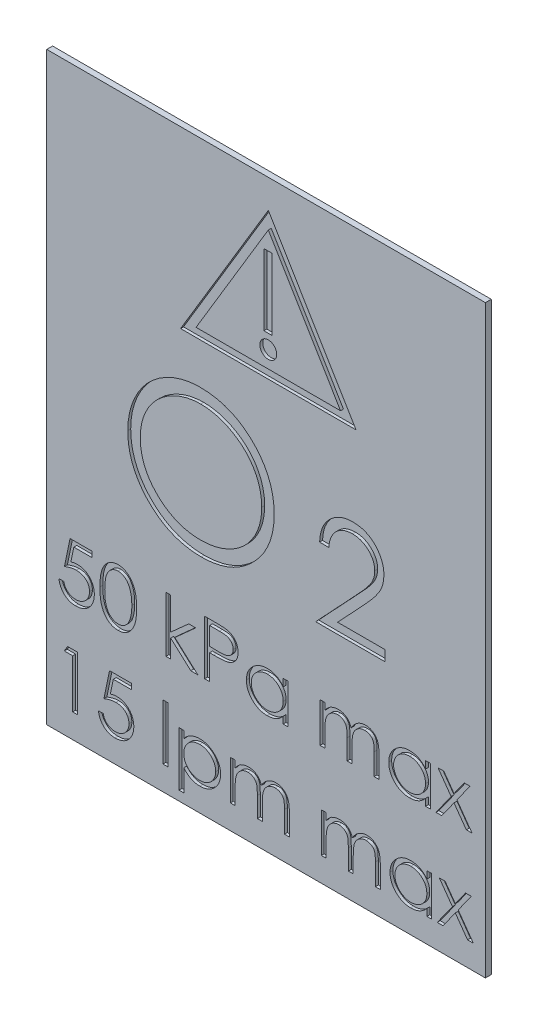
from build123d import *

# Parameters (mm, degrees)
ESQUISSE1_W             = 15
ESQUISSE1_H             = 20
EXTRUSION1_DEPTH        = 0.2
ENL_V_MAT_EXTRU_3_DEPTH = 0.1
ESQUISSE3_R             = 0.288745957
ESQUISSE3_W             = 0.2814226
ESQUISSE3_H             = 2.433639335
ENL_V_MAT_EXTRU_4_DEPTH = 0.1
ENL_V_MAT_EXTRU_5_DEPTH = 0.1
ENL_V_MAT_EXTRU_6_DEPTH = 0.1
ENL_V_MAT_EXTRU_7_DEPTH = 0.1
ESQUISSE7_W             = 0.166212606
ESQUISSE7_H             = 1.899572649
ENL_V_MAT_EXTRU_8_DEPTH = 0.1


with BuildPart() as part:
    # Esquisse1 → Extrusion1 (new body)
    with BuildSketch(Plane.XY):
        with Locations((-7.5, 15)):
            Rectangle(ESQUISSE1_W, ESQUISSE1_H)
    extrude(amount=EXTRUSION1_DEPTH)

    # Esquisse2 → Enlèv. mat.-Extru.3 (cut)
    with BuildSketch(Plane.XY.offset(0.2)):
        Polygon((-10.423651997, 19.021509333), (-4.423651997, 19.021509333), (-7.423651997, 24.021509333), align=None)
        Polygon((-7.423651997, 23.438414143), (-4.953509111, 19.321509333), (-9.893794883, 19.321509333), align=None, mode=Mode.SUBTRACT)
    extrude(amount=-ENL_V_MAT_EXTRU_3_DEPTH, mode=Mode.SUBTRACT)

    # Esquisse3 → Enlèv. mat.-Extru.4 (cut)
    with BuildSketch(Plane.XY.offset(0.2)):
        with Locations((-7.423651997, 19.89703825)):
            Circle(ESQUISSE3_R)
        with Locations((-7.432940697, 21.59700872)):
            Rectangle(ESQUISSE3_W, ESQUISSE3_H)
    extrude(amount=-ENL_V_MAT_EXTRU_4_DEPTH, mode=Mode.SUBTRACT)

    # Esquisse4 → Enlèv. mat.-Extru.5 (cut)
    with BuildSketch(Plane.XY.offset(0.2)):
        with BuildLine():
            add(Edge.make_bspline(
                [(-9.755871612, 17.617671925), (-9.667686297, 17.615438341), (-9.494483061, 17.611051397), (-9.239927575, 17.577470188), (-8.996910678, 17.519373961), (-8.763452739, 17.441999688), (-8.542346224, 17.338783543), (-8.331926874, 17.214026251), (-8.132695342, 17.066420784), (-7.947336963, 16.897108158), (-7.77771447, 16.712889958), (-7.628272817, 16.516296802), (-7.503029553, 16.30851736), (-7.400178893, 16.090176016), (-7.319490427, 15.861766559), (-7.2638113, 15.622071291), (-7.228244746, 15.372643259), (-7.224086706, 15.202517418), (-7.221977381, 15.116214594)],
                knots=[0, 0, 0, 0, 1.065120563, 2.091984664, 3.0946048, 4.079830382, 5.057816894, 6.036188127, 7.030412546, 8.04752943, 9.064399622, 10.05169764, 11.02544977, 11.989514704, 12.962713494, 13.945757189, 14.957906945, 16, 16, 16, 16], degree=3))
            add(Edge.make_bspline(
                [(-7.221977381, 15.116214594), (-7.224086397, 15.030547497), (-7.22824351, 14.861687725), (-7.26385174, 14.613842538), (-7.319696815, 14.375594126), (-7.399429591, 14.14734022), (-7.501789974, 13.928840035), (-7.627867189, 13.720668502), (-7.776377194, 13.522757373), (-7.945387231, 13.337274783), (-8.129629363, 13.167188938), (-8.327246261, 13.018981468), (-8.5337936, 12.891449713), (-8.75192931, 12.7896905), (-8.978760432, 12.708357994), (-9.216317093, 12.652905308), (-9.463486154, 12.617136152), (-9.632039198, 12.613028815), (-9.717710554, 12.610941156)],
                knots=[0, 0, 0, 0, 1.043624062, 2.057103931, 3.04512605, 4.022047818, 4.998200453, 5.980619268, 6.982898556, 8.009068085, 9.034988726, 10.034168286, 11.015286542, 11.987931943, 12.962482838, 13.94673481, 14.956375938, 16, 16, 16, 16], degree=3))
            add(Edge.make_bspline(
                [(-9.717710554, 12.610941156), (-9.804012931, 12.613049429), (-9.974137889, 12.617205396), (-10.223879355, 12.652830807), (-10.463743, 12.708540224), (-10.693042885, 12.78815485), (-10.911906878, 12.891048296), (-11.120763027, 13.016512112), (-11.318773009, 13.165383972), (-11.504295171, 13.334339204), (-11.674043187, 13.518269066), (-11.822033624, 13.715347106), (-11.947525653, 13.921706852), (-12.050073616, 14.137920983), (-12.131259898, 14.362944267), (-12.186647526, 14.598277731), (-12.222483232, 14.842579702), (-12.226612791, 15.00891736), (-12.228708151, 15.093317959)],
                knots=[0, 0, 0, 0, 1.053102029, 2.075944431, 3.073151272, 4.055350789, 5.033113405, 6.020478099, 7.024410459, 8.052272461, 9.079885166, 10.07527673, 11.055994387, 12.023226415, 12.992069828, 13.970394897, 14.97016774, 16, 16, 16, 16], degree=3))
            add(Edge.make_bspline(
                [(-12.228708151, 15.093317959), (-12.227980664, 15.149968127), (-12.22653487, 15.262553795), (-12.209129031, 15.429740133), (-12.183871859, 15.594237778), (-12.147674257, 15.755578961), (-12.100332738, 15.913368729), (-12.044472658, 16.068695303), (-11.976246654, 16.219984584), (-11.899120487, 16.367953271), (-11.813039241, 16.510294742), (-11.71795831, 16.644841604), (-11.617217327, 16.772722889), (-11.506777138, 16.890624705), (-11.390277618, 17.00197693), (-11.265828896, 17.105068341), (-11.134190342, 17.200828542), (-10.994795532, 17.287125507), (-10.851079237, 17.3651749), (-10.70292905, 17.432151776), (-10.552357072, 17.489636596), (-10.398658069, 17.536228576), (-10.24224019, 17.573011453), (-10.082762048, 17.598058602), (-9.920350692, 17.615508835), (-9.810933862, 17.616947793), (-9.755871612, 17.617671925)],
                knots=[0, 0, 0, 0, 1.037015668, 2.060948919, 3.074880161, 4.083647147, 5.086022904, 6.090072063, 7.104153813, 8.122640571, 9.144368836, 10.147691507, 11.138137339, 12.123020368, 13.103399296, 14.087645067, 15.080126199, 16.082011238, 17.087798457, 18.072939717, 19.057185487, 20.037253025, 21.01195951, 21.997135196, 22.992090687, 24, 24, 24, 24], degree=3))
        make_face()
        with BuildLine():
            add(Edge.make_bspline(
                [(-9.73488303, 17.129210387), (-9.780078657, 17.128659447), (-9.870037836, 17.127562834), (-10.003775009, 17.113117878), (-10.135753319, 17.092530422), (-10.266000022, 17.063164139), (-10.393970152, 17.023153624), (-10.520856543, 16.977105817), (-10.645502127, 16.92101569), (-10.767495412, 16.857643546), (-10.885761996, 16.787500193), (-10.997357851, 16.709977895), (-11.102571877, 16.626894648), (-11.201146465, 16.538056555), (-11.292792167, 16.443011204), (-11.379312779, 16.343199497), (-11.457240317, 16.235768531), (-11.528658191, 16.123631513), (-11.592568002, 16.006934504), (-11.649398717, 15.886906084), (-11.695886172, 15.76256716), (-11.733798905, 15.635266682), (-11.765231148, 15.505206263), (-11.785143737, 15.371399269), (-11.799747412, 15.234518063), (-11.800781345, 15.142014183), (-11.801304304, 15.095226012)],
                knots=[0, 0, 0, 0, 1.008559885, 2.007477868, 2.99961109, 3.989939068, 4.984837346, 5.991145699, 7.001802488, 8.033829008, 9.059044045, 10.069351652, 11.065060232, 12.050310815, 13.029377138, 14.011219647, 14.996725999, 15.989392538, 16.977580475, 17.965360261, 18.951710183, 19.937753436, 20.929683414, 21.935841486, 22.955955122, 24, 24, 24, 24], degree=3))
            add(Edge.make_bspline(
                [(-11.801304304, 15.095226012), (-11.799569582, 15.026425276), (-11.796156845, 14.891072943), (-11.766278866, 14.692724148), (-11.720256822, 14.502104015), (-11.652415191, 14.32025556), (-11.567573819, 14.145615661), (-11.462762229, 13.979733561), (-11.338584688, 13.822564429), (-11.197528246, 13.675205509), (-11.04332842, 13.540704611), (-10.879589956, 13.422644402), (-10.708067011, 13.322754026), (-10.528312296, 13.24137641), (-10.341285466, 13.176892516), (-10.14578137, 13.132698379), (-9.943102352, 13.103612492), (-9.804948139, 13.100819277), (-9.73488303, 13.099402695)],
                knots=[0, 0, 0, 0, 1.032063989, 2.030389145, 3.003944642, 3.970395727, 4.937377036, 5.913328081, 6.909231446, 7.93887556, 8.970685674, 9.976071282, 10.964166581, 11.944589148, 12.933237628, 13.927779006, 14.949070134, 16, 16, 16, 16], degree=3))
            add(Edge.make_bspline(
                [(-9.73488303, 13.099402695), (-9.687789387, 13.10004972), (-9.594388548, 13.101332966), (-9.455465713, 13.114257951), (-9.319045653, 13.134984174), (-9.185319715, 13.16482553), (-9.054439668, 13.202173336), (-8.92585924, 13.246543137), (-8.800947995, 13.301898632), (-8.678130144, 13.363059952), (-8.560569544, 13.432783167), (-8.448343909, 13.507674363), (-8.34428195, 13.590635236), (-8.245781107, 13.678153403), (-8.153759144, 13.771993496), (-8.068838348, 13.872033512), (-7.991304668, 13.978904906), (-7.919913913, 14.090871833), (-7.856228045, 14.207888163), (-7.800739342, 14.32835176), (-7.753663913, 14.451965998), (-7.715661198, 14.578909172), (-7.685881337, 14.708940184), (-7.665361875, 14.842233141), (-7.651008464, 14.978521389), (-7.649926591, 15.070701421), (-7.649381228, 15.11716862)],
                knots=[0, 0, 0, 0, 1.047197238, 2.076906641, 3.100256066, 4.114471768, 5.12198147, 6.126382909, 7.136867548, 8.15857795, 9.17633901, 10.174870724, 11.156907918, 12.133735059, 13.104061851, 14.077631395, 15.04955518, 16.038496417, 17.029181396, 18.010275684, 18.986308667, 19.968651475, 20.955262928, 21.950658345, 22.966943676, 24, 24, 24, 24], degree=3))
            add(Edge.make_bspline(
                [(-7.649381228, 15.11716862), (-7.649927028, 15.163317931), (-7.651009723, 15.254863591), (-7.665355019, 15.390201347), (-7.685903016, 15.522535181), (-7.715515844, 15.651345571), (-7.753684089, 15.776665349), (-7.800747563, 15.898376817), (-7.856244703, 16.016933396), (-7.919937322, 16.132042065), (-7.991532425, 16.242497691), (-8.069765663, 16.348092402), (-8.155987798, 16.446843168), (-8.247735353, 16.541187876), (-8.347300022, 16.629114362), (-8.454230794, 16.710651792), (-8.567229512, 16.787767926), (-8.686873358, 16.857335208), (-8.810349952, 16.921580289), (-8.937051445, 16.976622547), (-9.065542469, 17.023393181), (-9.195496279, 17.063285194), (-9.328006689, 17.092415406), (-9.462178328, 17.113136431), (-9.597825565, 17.127557806), (-9.689052232, 17.128657779), (-9.73488303, 17.129210387)],
                knots=[0, 0, 0, 0, 1.02996197, 2.043119294, 3.035359645, 4.018872909, 4.991431989, 5.957985074, 6.929999688, 7.912076566, 8.892894881, 9.867085534, 10.843653904, 11.817741046, 12.803660682, 13.806313499, 14.818574707, 15.856120519, 16.894564902, 17.924820532, 18.937903209, 19.946497019, 20.957711757, 21.963978472, 22.977135795, 24, 24, 24, 24], degree=3))
        make_face(mode=Mode.SUBTRACT)
    extrude(amount=-ENL_V_MAT_EXTRU_5_DEPTH, mode=Mode.SUBTRACT)

    # Esquisse5 → Enlèv. mat.-Extru.6 (cut)
    with BuildSketch(Plane.XY.offset(0.2)):
        with BuildLine():
            Line((-5.355231282, 15.072962102), (-5.669333846, 15.072962102))
            add(Edge.make_bspline(
                [(-5.669333846, 15.072962102), (-5.667286693, 15.11463299), (-5.663266139, 15.196473505), (-5.64443785, 15.315797411), (-5.617496972, 15.42985221), (-5.579405518, 15.537722124), (-5.532099241, 15.640360931), (-5.475369213, 15.737360947), (-5.408175363, 15.828352135), (-5.331968629, 15.912490979), (-5.24919999, 15.98967855), (-5.15989405, 16.056333792), (-5.066049023, 16.112651464), (-4.967949624, 16.159732706), (-4.86448906, 16.195072551), (-4.756606202, 16.221294191), (-4.643827066, 16.237070537), (-4.566987044, 16.238766322), (-4.527907564, 16.239628769)],
                knots=[0, 0, 0, 0, 1.10065271, 2.161652631, 3.183658789, 4.190468796, 5.17591951, 6.163126047, 7.15150782, 8.156236427, 9.156009102, 10.134482811, 11.092018607, 12.041330605, 13.001268258, 13.972401359, 14.968799086, 16, 16, 16, 16], degree=3))
            add(Edge.make_bspline(
                [(-4.527907564, 16.239628769), (-4.48952949, 16.238730313), (-4.414117945, 16.236964878), (-4.304055931, 16.221803849), (-4.199278636, 16.198058257), (-4.09999087, 16.164742841), (-4.006984805, 16.119958413), (-3.91956176, 16.066160875), (-3.83668095, 16.003941043), (-3.762074166, 15.93068723), (-3.693566087, 15.852484845), (-3.634463832, 15.768996942), (-3.583850668, 15.682767656), (-3.541662988, 15.593139454), (-3.510606849, 15.499268426), (-3.487028641, 15.402521223), (-3.473701228, 15.301896412), (-3.471655804, 15.233789856), (-3.470615897, 15.199164025)],
                knots=[0, 0, 0, 0, 1.111607364, 2.184268762, 3.212621178, 4.221274766, 5.211760367, 6.196651075, 7.1921475, 8.207485113, 9.220403448, 10.201281604, 11.166441695, 12.114753415, 13.065576456, 14.026450734, 14.996634279, 16, 16, 16, 16], degree=3))
            add(Edge.make_bspline(
                [(-3.470615897, 15.199164025), (-3.47230916, 15.150416191), (-3.475665971, 15.053775977), (-3.504380348, 14.911761114), (-3.549226859, 14.774167695), (-3.603224216, 14.663430393), (-3.65769666, 14.5741969), (-3.706784167, 14.500728195), (-3.764248978, 14.421622726), (-3.830927476, 14.337145389), (-3.905440349, 14.246634484), (-3.988462512, 14.150144688), (-4.080585994, 14.048672919), (-4.145244495, 13.979367317), (-4.17874891, 13.943454891)],
                knots=[0, 0, 0, 0, 1.184426356, 2.348067706, 3.509069118, 4.696110526, 5.333549288, 6.050745305, 6.844228056, 7.710549037, 8.667450064, 9.695053472, 10.805634456, 12, 12, 12, 12], degree=3))
            Line((-4.17874891, 13.943454891), (-5.054450032, 13.008859538))
            Line((-5.054450032, 13.008859538), (-3.425744102, 13.008859538))
            Line((-3.425744102, 13.008859538), (-3.425744102, 12.649885179))
            Line((-3.425744102, 12.649885179), (-5.80394923, 12.649885179))
            Line((-5.80394923, 12.649885179), (-4.446577436, 14.098402808))
            add(Edge.make_bspline(
                [(-4.446577436, 14.098402808), (-4.413529549, 14.132901114), (-4.350051322, 14.199165301), (-4.260268745, 14.295908261), (-4.179629756, 14.385657802), (-4.107612364, 14.46824435), (-4.045778858, 14.544875918), (-3.990906626, 14.613070621), (-3.946941035, 14.675825072), (-3.89922564, 14.748565686), (-3.853011658, 14.837378003), (-3.813299302, 14.945911692), (-3.789084454, 15.057638945), (-3.786179618, 15.133140982), (-3.784718461, 15.171119154)],
                knots=[0, 0, 0, 0, 1.329631726, 2.553950428, 3.673215718, 4.687767853, 5.603093632, 6.413772471, 7.123043292, 7.734684054, 8.834405432, 9.900288307, 10.943827018, 12, 12, 12, 12], degree=3))
            add(Edge.make_bspline(
                [(-3.784718461, 15.171119154), (-3.785354203, 15.195000552), (-3.786607129, 15.242066202), (-3.797664827, 15.311071961), (-3.814375333, 15.377636775), (-3.838320591, 15.441965394), (-3.869927331, 15.503411046), (-3.908400711, 15.562048527), (-3.952790775, 15.618737492), (-4.004142044, 15.67189079), (-4.060553564, 15.720571995), (-4.120147813, 15.763696081), (-4.183197918, 15.799735192), (-4.24943804, 15.829278689), (-4.318683509, 15.85245407), (-4.391068254, 15.868512649), (-4.466392271, 15.878595133), (-4.517825766, 15.879959305), (-4.544033365, 15.88065441)],
                knots=[0, 0, 0, 0, 0.991446411, 1.95395049, 2.89581595, 3.838931463, 4.798493298, 5.75982156, 6.748411868, 7.785213223, 8.824556874, 9.840280684, 10.836137867, 11.835679398, 12.848801643, 13.863922112, 14.911575587, 16, 16, 16, 16], degree=3))
            add(Edge.make_bspline(
                [(-4.544033365, 15.88065441), (-4.571404198, 15.879939378), (-4.625155994, 15.878535172), (-4.704075027, 15.868712509), (-4.779360804, 15.851766668), (-4.851202707, 15.828589994), (-4.919722293, 15.799131445), (-4.984586337, 15.7624397), (-5.045649227, 15.718656207), (-5.10302575, 15.669015651), (-5.155889729, 15.61374805), (-5.202336605, 15.552138086), (-5.242920619, 15.485310671), (-5.278329852, 15.413446121), (-5.307085543, 15.335892341), (-5.329058693, 15.252924636), (-5.34644554, 15.164903254), (-5.35225406, 15.104118169), (-5.355231282, 15.072962102)],
                knots=[0, 0, 0, 0, 1.031018746, 2.02475058, 2.990194455, 3.934040569, 4.864654155, 5.795059489, 6.735614925, 7.690564532, 8.649604399, 9.611025574, 10.590972636, 11.591080095, 12.624614302, 13.701020113, 14.821632451, 16, 16, 16, 16], degree=3))
        make_face()
    extrude(amount=-ENL_V_MAT_EXTRU_6_DEPTH, mode=Mode.SUBTRACT)

    # Esquisse6 → Enlèv. mat.-Extru.7 (cut)
    # profile 1 of 8: a face of its own
    with BuildSketch(Plane.XY.offset(0.2)):
        with BuildLine():
            Line((-13.444138821, 10.913566039), (-13.444138821, 10.723608774))
            Line((-13.444138821, 10.723608774), (-14.074114282, 10.723608774))
            Line((-14.074114282, 10.723608774), (-14.173916048, 10.236472272))
            add(Edge.make_bspline(
                [(-14.173916048, 10.236472272), (-14.154307314, 10.241885791), (-14.116318494, 10.252373628), (-14.060248068, 10.264018348), (-14.007018027, 10.271037979), (-13.972476477, 10.271996464), (-13.955762001, 10.27246027)],
                knots=[0, 0, 0, 0, 1.100273476, 2.13160584, 3.095893838, 4, 4, 4, 4], degree=3))
            add(Edge.make_bspline(
                [(-13.955762001, 10.27246027), (-13.935080189, 10.272012629), (-13.894414579, 10.271132455), (-13.834915636, 10.262680685), (-13.778118647, 10.24937748), (-13.724142392, 10.23079287), (-13.672887018, 10.207028136), (-13.6248241, 10.177341918), (-13.579232204, 10.142663864), (-13.536929248, 10.102793795), (-13.498551802, 10.058914439), (-13.464808965, 10.011735066), (-13.436147928, 9.961714178), (-13.413097029, 9.908373856), (-13.394690318, 9.852303804), (-13.382439055, 9.792914062), (-13.374281046, 9.730764432), (-13.373369617, 9.68826993), (-13.372904846, 9.666600477)],
                knots=[0, 0, 0, 0, 1.052922333, 2.070308379, 3.05430497, 4.020497103, 4.973039431, 5.925935799, 6.892292201, 7.88610001, 8.88166317, 9.857072816, 10.836096531, 11.812156883, 12.81219415, 13.836441305, 14.89672472, 16, 16, 16, 16], degree=3))
            add(Edge.make_bspline(
                [(-13.372904846, 9.666600477), (-13.373256782, 9.651507469), (-13.373955897, 9.621525422), (-13.37751115, 9.576999115), (-13.3843563, 9.53341545), (-13.39354672, 9.490768642), (-13.405475417, 9.449139433), (-13.419915874, 9.408408666), (-13.437587939, 9.368829853), (-13.456972042, 9.330028498), (-13.478798303, 9.292881788), (-13.503022763, 9.258142533), (-13.528616169, 9.225289601), (-13.556154735, 9.194675334), (-13.585894428, 9.166500903), (-13.617475078, 9.140599104), (-13.650644683, 9.1165319), (-13.685916415, 9.09527623), (-13.722504313, 9.075716666), (-13.760936744, 9.059670461), (-13.800338865, 9.045324473), (-13.841277778, 9.033889431), (-13.883660754, 9.024929288), (-13.927557656, 9.018843554), (-13.972738261, 9.014411022), (-14.003363788, 9.01413355), (-14.018833749, 9.013993389)],
                knots=[0, 0, 0, 0, 1.056347294, 2.098418968, 3.122841568, 4.141288669, 5.149314143, 6.15115421, 7.162517403, 8.180376062, 9.185164535, 10.17417709, 11.141909838, 12.097768115, 13.052685741, 14.0056014, 14.954263652, 15.917497458, 16.885230207, 17.854509472, 18.828990115, 19.81800267, 20.826176721, 21.857883937, 22.917946725, 24, 24, 24, 24], degree=3))
            add(Edge.make_bspline(
                [(-14.018833749, 9.013993389), (-14.037288003, 9.014358958), (-14.073594568, 9.015078171), (-14.126786701, 9.022602119), (-14.177964847, 9.033378025), (-14.226717025, 9.049589718), (-14.273480152, 9.069902994), (-14.317624674, 9.095576135), (-14.360278564, 9.124669244), (-14.39970785, 9.159001764), (-14.43630296, 9.196527979), (-14.469061821, 9.237251398), (-14.498236672, 9.280499894), (-14.523360313, 9.326483501), (-14.544790516, 9.37508139), (-14.561625947, 9.426475645), (-14.575214077, 9.48039773), (-14.580962637, 9.517520629), (-14.583882411, 9.536375868)],
                knots=[0, 0, 0, 0, 1.0467383, 2.05933395, 3.04377827, 4.011590433, 4.970194871, 5.932262533, 6.905835911, 7.896367577, 8.894135286, 9.877477877, 10.858688626, 11.851381753, 12.8477658, 13.868841284, 14.917554742, 16, 16, 16, 16], degree=3))
            Line((-14.583882411, 9.536375868), (-14.417669804, 9.536375868))
            add(Edge.make_bspline(
                [(-14.417669804, 9.536375868), (-14.413580109, 9.518714162), (-14.405719488, 9.484767382), (-14.388465613, 9.437072881), (-14.36736992, 9.394570625), (-14.342285119, 9.356698387), (-14.312360728, 9.323673626), (-14.278213905, 9.294242931), (-14.239929902, 9.267691925), (-14.197388484, 9.245560711), (-14.15250823, 9.226685995), (-14.105535581, 9.21411739), (-14.057749531, 9.205279834), (-14.025428894, 9.204395194), (-14.009187482, 9.203950654)],
                knots=[0, 0, 0, 0, 1.136247022, 2.183929868, 3.172523383, 4.106158343, 5.02341133, 5.958108904, 6.928429099, 7.938127109, 8.96079061, 9.975095812, 10.982467395, 12, 12, 12, 12], degree=3))
            add(Edge.make_bspline(
                [(-14.009187482, 9.203950654), (-13.993334472, 9.204384983), (-13.962119765, 9.205240179), (-13.916182073, 9.211822489), (-13.871831094, 9.221960037), (-13.829504451, 9.237131169), (-13.788461469, 9.255569833), (-13.749740349, 9.27923156), (-13.71222091, 9.306462487), (-13.677069356, 9.33766037), (-13.644875147, 9.372040167), (-13.6164292, 9.408805287), (-13.59273475, 9.448025452), (-13.572767117, 9.489021662), (-13.557604747, 9.532243232), (-13.546788061, 9.577487604), (-13.540436442, 9.624866531), (-13.539562693, 9.657182374), (-13.539117453, 9.673649673)],
                knots=[0, 0, 0, 0, 1.027316725, 2.022795036, 3.002884548, 3.971462791, 4.93288096, 5.914575861, 6.907176829, 7.935150275, 8.956128384, 9.956726525, 10.942570165, 11.921478529, 12.907843606, 13.90538589, 14.932640048, 16, 16, 16, 16], degree=3))
            add(Edge.make_bspline(
                [(-13.539117453, 9.673649673), (-13.539465899, 9.688506425), (-13.540147931, 9.717586403), (-13.545720358, 9.760130983), (-13.555413089, 9.800386301), (-13.568866559, 9.83854675), (-13.585947798, 9.874648321), (-13.606821472, 9.908728274), (-13.631879312, 9.940337427), (-13.660502936, 9.96949057), (-13.691860316, 9.996395983), (-13.726490963, 10.019332229), (-13.763670174, 10.038627719), (-13.802950004, 10.055279535), (-13.845264763, 10.067239096), (-13.889776481, 10.076217935), (-13.936965822, 10.081411898), (-13.969229478, 10.082132564), (-13.985813834, 10.082503005)],
                knots=[0, 0, 0, 0, 1.045622112, 2.046656509, 3.013763289, 3.955457236, 4.890082067, 5.820317437, 6.762574623, 7.722996705, 8.69280354, 9.665887285, 10.63943826, 11.638615906, 12.663482002, 13.728887084, 14.832589034, 16, 16, 16, 16], degree=3))
            add(Edge.make_bspline(
                [(-13.985813834, 10.082503005), (-14.000169559, 10.082195775), (-14.029810489, 10.081561424), (-14.075277984, 10.076890737), (-14.123057355, 10.069355777), (-14.172965442, 10.058991387), (-14.225152127, 10.045428276), (-14.279507281, 10.029175186), (-14.336145189, 10.009743128), (-14.374307485, 9.995068165), (-14.393925146, 9.987524372)],
                knots=[0, 0, 0, 0, 0.817624296, 1.688186739, 2.600797293, 3.572016777, 4.590301741, 5.671205678, 6.80286297, 8, 8, 8, 8], degree=3))
            Line((-14.393925146, 9.987524372), (-14.203967881, 10.913566039))
            Line((-14.203967881, 10.913566039), (-13.444138821, 10.913566039))
        make_face()
    # profile 2 of 8: a face of its own
    with BuildSketch(Plane.XY.offset(0.2)):
        with BuildLine():
            add(Edge.make_bspline(
                [(-13.182947581, 9.986782352), (-13.182774005, 10.016467219), (-13.182436831, 10.074130503), (-13.178685875, 10.158154043), (-13.172454756, 10.236978862), (-13.163915396, 10.310608735), (-13.153523632, 10.379062668), (-13.13965127, 10.442157727), (-13.123875329, 10.500185936), (-13.105591326, 10.55333652), (-13.084960288, 10.602325554), (-13.062505491, 10.64805889), (-13.037335788, 10.690467329), (-13.010889671, 10.730227743), (-12.982096617, 10.766689282), (-12.951776007, 10.800366857), (-12.918744431, 10.830482129), (-12.884124755, 10.857917465), (-12.847603543, 10.88196781), (-12.810221799, 10.903151801), (-12.771722222, 10.921249231), (-12.7319997, 10.935478753), (-12.691411263, 10.947231993), (-12.649815024, 10.955269477), (-12.607142302, 10.960326675), (-12.578339001, 10.960810157), (-12.563731419, 10.961055355)],
                knots=[0, 0, 0, 0, 1.646270934, 3.197905019, 4.663502075, 6.030701355, 7.308322542, 8.50163776, 9.611534131, 10.641858119, 11.616356847, 12.558055219, 13.465016945, 14.349605745, 15.204443733, 16.039544428, 16.859896111, 17.680448484, 18.487036065, 19.28249412, 20.06191084, 20.843045899, 21.620316918, 22.403196591, 23.190181807, 24, 24, 24, 24], degree=3))
            add(Edge.make_bspline(
                [(-12.563731419, 10.961055355), (-12.549001812, 10.96079722), (-12.519709257, 10.960283869), (-12.476402058, 10.95534995), (-12.434095352, 10.947163147), (-12.392969503, 10.935563298), (-12.352686698, 10.921172253), (-12.313562016, 10.903134486), (-12.275352435, 10.882137752), (-12.238665158, 10.857465951), (-12.203097424, 10.829958663), (-12.169522877, 10.798863417), (-12.13793846, 10.764494191), (-12.107947778, 10.727218705), (-12.080401691, 10.686322014), (-12.054169083, 10.642515422), (-12.030688881, 10.59503284), (-12.008075115, 10.544666509), (-11.988555752, 10.490022823), (-11.970952363, 10.431409804), (-11.956728909, 10.36813513), (-11.944881253, 10.300530783), (-11.935702912, 10.22834849), (-11.929018139, 10.151742981), (-11.925486965, 10.070663858), (-11.92482196, 10.015229496), (-11.924480701, 9.986782352)],
                knots=[0, 0, 0, 0, 0.810914788, 1.612654377, 2.396697861, 3.181598691, 3.963628158, 4.749916497, 5.551656086, 6.361998678, 7.18212741, 8.025565596, 8.878627764, 9.750805457, 10.657531673, 11.591944965, 12.560506719, 13.57287815, 14.630710178, 15.753379473, 16.941251878, 18.199788006, 19.531962791, 20.947069417, 22.433333509, 24, 24, 24, 24], degree=3))
            add(Edge.make_bspline(
                [(-11.924480701, 9.986782352), (-11.924825498, 9.958459284), (-11.92549732, 9.903272941), (-11.928978553, 9.822558633), (-11.935835828, 9.746359669), (-11.944413614, 9.674493299), (-11.956293915, 9.607258642), (-11.970901649, 9.544423038), (-11.987120778, 9.485715134), (-12.00714169, 9.431615879), (-12.029054858, 9.381370593), (-12.052896566, 9.334450893), (-12.078439349, 9.290442063), (-12.106267559, 9.249696364), (-12.135929157, 9.211925158), (-12.168058987, 9.177795166), (-12.201751338, 9.146484019), (-12.237423742, 9.118622532), (-12.274683188, 9.09423599), (-12.312761533, 9.072426994), (-12.352334406, 9.05484136), (-12.39250501, 9.039741567), (-12.433847937, 9.028205495), (-12.476311653, 9.020228913), (-12.519680161, 9.014634643), (-12.548996822, 9.014207881), (-12.563731419, 9.013993389)],
                knots=[0, 0, 0, 0, 1.561518951, 3.042555995, 4.452378317, 5.7783523, 7.031515105, 8.214008947, 9.334062868, 10.386615937, 11.391082383, 12.354592575, 13.286541444, 14.194233754, 15.072674879, 15.931287219, 16.775624067, 17.606195743, 18.42308326, 19.229000347, 20.022332153, 20.807536673, 21.593273796, 22.3848459, 23.188221202, 24, 24, 24, 24], degree=3))
            add(Edge.make_bspline(
                [(-12.563731419, 9.013993389), (-12.578338596, 9.014240169), (-12.607141098, 9.014726771), (-12.649819673, 9.01976112), (-12.691244133, 9.027854991), (-12.73161889, 9.039187944), (-12.771151087, 9.053059961), (-12.809302039, 9.071132952), (-12.846495938, 9.09194723), (-12.882633554, 9.115651474), (-12.917035822, 9.142809198), (-12.949896334, 9.172846968), (-12.980389573, 9.206514356), (-13.008770949, 9.243279757), (-13.035744737, 9.282804931), (-13.060557031, 9.325629529), (-13.083507441, 9.371583743), (-13.104485455, 9.420964471), (-13.123084956, 9.474492287), (-13.139514368, 9.532779561), (-13.152486443, 9.596340751), (-13.163589924, 9.664665358), (-13.172545743, 9.73804698), (-13.178659907, 9.816525454), (-13.182438853, 9.900051877), (-13.182774911, 9.957344633), (-13.182947581, 9.986782352)],
                knots=[0, 0, 0, 0, 0.810891512, 1.598919785, 2.382837074, 3.152667961, 3.926044502, 4.706494248, 5.493654104, 6.291793342, 7.103789334, 7.925228297, 8.761435821, 9.622817696, 10.50288917, 11.416980706, 12.369136599, 13.353924996, 14.394355917, 15.514179734, 16.714354668, 17.994756427, 19.357759367, 20.818452758, 22.365282078, 24, 24, 24, 24], degree=3))
        make_face()
        with BuildLine():
            add(Edge.make_bspline(
                [(-13.016734975, 9.987524372), (-13.016671767, 9.962786519), (-13.016549094, 9.914775204), (-13.013344355, 9.845008145), (-13.008978607, 9.779936346), (-13.003347587, 9.719477183), (-12.994985193, 9.663835301), (-12.985615352, 9.612628011), (-12.974212821, 9.566126306), (-12.960721707, 9.52401109), (-12.945355185, 9.485567624), (-12.928577499, 9.449795314), (-12.9105537, 9.416271581), (-12.890382316, 9.385297547), (-12.868413928, 9.356772202), (-12.845144745, 9.330190661), (-12.819706336, 9.306485592), (-12.784514772, 9.278055131), (-12.738055805, 9.248676256), (-12.679519147, 9.223093117), (-12.619369592, 9.207015734), (-12.578543722, 9.204971163), (-12.558166265, 9.203950654)],
                knots=[0, 0, 0, 0, 1.459021318, 2.831673884, 4.118529203, 5.306027144, 6.411944654, 7.436330062, 8.375795394, 9.233974572, 10.042671642, 10.816086306, 11.563610507, 12.285937304, 12.993564865, 13.685989202, 14.367179055, 15.041617293, 16.353048772, 17.594441528, 18.799311195, 20, 20, 20, 20], degree=3))
            add(Edge.make_bspline(
                [(-12.558166265, 9.203950654), (-12.537656997, 9.204796147), (-12.496680805, 9.206485386), (-12.436814172, 9.222783051), (-12.378695654, 9.247373182), (-12.333149252, 9.276449571), (-12.298498073, 9.304139978), (-12.273671165, 9.327748563), (-12.250884165, 9.354183543), (-12.2292719, 9.382705254), (-12.209449806, 9.41385861), (-12.191424729, 9.447493806), (-12.174976458, 9.483704246), (-12.165605421, 9.508982399), (-12.160814251, 9.521906467)],
                knots=[0, 0, 0, 0, 1.353760809, 2.704726607, 4.075137775, 5.516104923, 6.260822281, 7.007110065, 7.778089737, 8.566572457, 9.372053459, 10.217411131, 11.088608312, 12, 12, 12, 12], degree=3))
            add(Edge.make_bspline(
                [(-12.160814251, 9.521906467), (-12.155230608, 9.538432204), (-12.143893416, 9.571986538), (-12.129282186, 9.624037304), (-12.117775245, 9.678648766), (-12.107422964, 9.735494557), (-12.100356972, 9.794993899), (-12.094669588, 9.856962694), (-12.091319599, 9.921447665), (-12.090904335, 9.965260014), (-12.090693308, 9.987524372)],
                knots=[0, 0, 0, 0, 0.884706709, 1.796334032, 2.740027952, 3.714592787, 4.726048262, 5.777819803, 6.87074269, 8, 8, 8, 8], degree=3))
            add(Edge.make_bspline(
                [(-12.090693308, 9.987524372), (-12.09098445, 10.009785129), (-12.091553985, 10.053331929), (-12.093730971, 10.117106133), (-12.099352612, 10.177678657), (-12.105596312, 10.235310448), (-12.114802342, 10.289682484), (-12.124728348, 10.341249937), (-12.13806399, 10.389373954), (-12.152309037, 10.434807983), (-12.168612871, 10.477035829), (-12.186559948, 10.516254374), (-12.205727295, 10.552652958), (-12.226545897, 10.586131714), (-12.248768613, 10.616840602), (-12.272981982, 10.644163908), (-12.298225546, 10.66894847), (-12.333582974, 10.69723908), (-12.379871452, 10.726084852), (-12.437468941, 10.7526309), (-12.49740799, 10.767875288), (-12.537928109, 10.770024597), (-12.558166265, 10.77109809)],
                knots=[0, 0, 0, 0, 1.31362396, 2.569729283, 3.763502607, 4.902122613, 5.988968491, 7.01645872, 7.998833611, 8.933434873, 9.825090667, 10.667526885, 11.477055099, 12.250526234, 12.991942729, 13.710640831, 14.402115721, 15.076753259, 16.378508321, 17.609869233, 18.806226677, 20, 20, 20, 20], degree=3))
            add(Edge.make_bspline(
                [(-12.558166265, 10.77109809), (-12.57865062, 10.770023116), (-12.619656647, 10.76787121), (-12.68021869, 10.752687697), (-12.738270576, 10.726222503), (-12.78443665, 10.697143539), (-12.819818737, 10.669447849), (-12.844733329, 10.64543085), (-12.868094012, 10.619159707), (-12.889614003, 10.590372028), (-12.909769582, 10.559434104), (-12.928280368, 10.526102549), (-12.944958288, 10.490208452), (-12.960348855, 10.451782255), (-12.973881122, 10.409670672), (-12.985043345, 10.363226246), (-12.995355244, 10.312181829), (-13.00265524, 10.256238589), (-13.009144811, 10.195764283), (-13.013315357, 10.130530035), (-13.016559814, 10.060645967), (-13.016675418, 10.012386413), (-13.016734975, 9.987524372)],
                knots=[0, 0, 0, 0, 1.207732386, 2.417664972, 3.655092373, 4.956220595, 5.625982001, 6.301752483, 6.994047911, 7.697131622, 8.419323945, 9.170223765, 9.943494443, 10.752040957, 11.610060368, 12.549350801, 13.567764191, 14.679664412, 15.874934091, 17.154273443, 18.533957287, 20, 20, 20, 20], degree=3))
        make_face(mode=Mode.SUBTRACT)
    # profile 3 of 8: a face of its own
    with BuildSketch(Plane.XY.offset(0.2)):
        Polygon((-10.92720506, 10.961055355), (-10.760992453, 10.961055355), (-10.760992453, 9.862864917), (-10.145115383, 10.414928219), (-9.906184761, 10.414928219), (-10.620750566, 9.773822449), (-9.834950787, 9.061482706), (-10.073510399, 9.061482706), (-10.760992453, 9.685150992), (-10.760992453, 9.061482706), (-10.92720506, 9.061482706), align=None)
    # profile 4 of 8: a face of its own
    with BuildSketch(Plane.XY.offset(0.2)):
        with BuildLine():
            Line((-9.597504205, 10.913566039), (-9.234285138, 10.913566039))
            add(Edge.make_bspline(
                [(-9.234285138, 10.913566039), (-9.2093027, 10.913538577), (-9.16143524, 10.913485959), (-9.092794356, 10.911890656), (-9.030453373, 10.909759865), (-8.974546713, 10.906806113), (-8.924902362, 10.903315418), (-8.881744957, 10.898419547), (-8.844735275, 10.89330764), (-8.822559779, 10.888110479), (-8.812446446, 10.885740268)],
                knots=[0, 0, 0, 0, 1.415646017, 2.712440637, 3.8905458, 4.950247383, 5.884950622, 6.709939814, 7.411656543, 8, 8, 8, 8], degree=3))
            add(Edge.make_bspline(
                [(-8.812446446, 10.885740268), (-8.799644035, 10.882236153), (-8.774340884, 10.875310493), (-8.737880749, 10.861439064), (-8.703191839, 10.844991418), (-8.670155139, 10.82624625), (-8.63917662, 10.804399306), (-8.60979409, 10.780336183), (-8.582266851, 10.753501311), (-8.556749698, 10.72419567), (-8.533315659, 10.692911225), (-8.513138702, 10.659180962), (-8.496243877, 10.623572647), (-8.481753563, 10.586111049), (-8.471324506, 10.546481586), (-8.463468021, 10.504959618), (-8.458481352, 10.461549594), (-8.458003746, 10.431884581), (-8.457760616, 10.41678327)],
                knots=[0, 0, 0, 0, 0.999701418, 1.975846123, 2.934577507, 3.890451536, 4.834027766, 5.787354733, 6.749476667, 7.726910423, 8.712836071, 9.690891519, 10.682875813, 11.679750201, 12.712814741, 13.765529915, 14.8625177, 16, 16, 16, 16], degree=3))
            add(Edge.make_bspline(
                [(-8.457760616, 10.41678327), (-8.45798362, 10.40155503), (-8.458419942, 10.371759949), (-8.463656726, 10.328171015), (-8.470710619, 10.286515867), (-8.481556976, 10.246886866), (-8.495762811, 10.209519355), (-8.512427356, 10.173842286), (-8.532526974, 10.140462626), (-8.555622363, 10.109259193), (-8.581314249, 10.080202698), (-8.609493928, 10.053503703), (-8.640047637, 10.02931849), (-8.672878274, 10.007592842), (-8.708305902, 9.98883056), (-8.745793209, 9.972025653), (-8.785666031, 9.957912217), (-8.813258112, 9.950487976), (-8.827286858, 9.946713241)],
                knots=[0, 0, 0, 0, 1.121902311, 2.195077645, 3.232258892, 4.234102512, 5.217864754, 6.176164875, 7.132989551, 8.084763148, 9.034132444, 9.988522005, 10.94243251, 11.903244335, 12.886203696, 13.894208494, 14.929344452, 16, 16, 16, 16], degree=3))
            add(Edge.make_bspline(
                [(-8.827286858, 9.946713241), (-8.838890072, 9.944245747), (-8.864319191, 9.93883809), (-8.906198881, 9.932801115), (-8.954959148, 9.927648301), (-9.010533438, 9.923784783), (-9.072871866, 9.920477296), (-9.142008157, 9.917848346), (-9.218078023, 9.916403799), (-9.271138223, 9.916329296), (-9.298840927, 9.916290398)],
                knots=[0, 0, 0, 0, 0.601384939, 1.31797006, 2.144135048, 3.087295005, 4.142315834, 5.309527816, 6.595305764, 8, 8, 8, 8], degree=3))
            Line((-9.298840927, 9.916290398), (-9.431291599, 9.916290398))
            Line((-9.431291599, 9.916290398), (-9.431291599, 9.061482706))
            Line((-9.431291599, 9.061482706), (-9.597504205, 9.061482706))
            Line((-9.597504205, 9.061482706), (-9.597504205, 10.913566039))
        make_face()
        with BuildLine():
            Line((-9.431291599, 10.723608774), (-9.431291599, 10.106247663))
            Line((-9.431291599, 10.106247663), (-9.107028611, 10.10216655))
            add(Edge.make_bspline(
                [(-9.107028611, 10.10216655), (-9.091195984, 10.102158367), (-9.060631423, 10.10214257), (-9.016479755, 10.104251418), (-8.97551734, 10.106685866), (-8.937870002, 10.110250292), (-8.90352077, 10.115288624), (-8.87241237, 10.120374836), (-8.844786016, 10.12773309), (-8.812454355, 10.137640714), (-8.776426917, 10.15453839), (-8.737232839, 10.179065207), (-8.704016737, 10.210328748), (-8.675273305, 10.245480142), (-8.652463111, 10.284585098), (-8.635764732, 10.326425744), (-8.62595337, 10.370572981), (-8.624637759, 10.400782121), (-8.623973222, 10.416041249)],
                knots=[0, 0, 0, 0, 1.160613943, 2.240541288, 3.23993089, 4.169200891, 5.011653406, 5.7853311, 6.478053781, 7.106038997, 8.262395093, 9.384106736, 10.481365981, 11.59014053, 12.70357646, 13.786202915, 14.881775077, 16, 16, 16, 16], degree=3))
            add(Edge.make_bspline(
                [(-8.623973222, 10.416041249), (-8.624641373, 10.430931213), (-8.625969573, 10.460530617), (-8.635841634, 10.503911045), (-8.652430646, 10.545310771), (-8.675426427, 10.583925696), (-8.703335275, 10.618950605), (-8.735772844, 10.649376168), (-8.772662779, 10.673835152), (-8.806978301, 10.68962193), (-8.837458928, 10.699260847), (-8.863934174, 10.706004991), (-8.893827156, 10.711389583), (-8.927147606, 10.715749653), (-8.963637264, 10.71948211), (-9.003609622, 10.72201469), (-9.046913258, 10.723497127), (-9.076975519, 10.723570657), (-9.09255921, 10.723608774)],
                knots=[0, 0, 0, 0, 1.120700087, 2.227813068, 3.331159281, 4.466773991, 5.599788987, 6.693661531, 7.80175334, 8.91857717, 9.525282508, 10.207424825, 10.974604443, 11.810962634, 12.737642355, 13.736264703, 14.826523623, 16, 16, 16, 16], degree=3))
            Line((-9.09255921, 10.723608774), (-9.431291599, 10.723608774))
        make_face(mode=Mode.SUBTRACT)
    # profile 5 of 8: a face of its own
    with BuildSketch(Plane.XY.offset(0.2)):
        with BuildLine():
            Line((-6.748145231, 10.414928219), (-6.748145231, 9.061482706))
            Line((-6.748145231, 9.061482706), (-6.914357838, 9.061482706))
            Line((-6.914357838, 9.061482706), (-6.914357838, 9.295590194))
            add(Edge.make_bspline(
                [(-6.914357838, 9.295590194), (-6.933100281, 9.274402576), (-6.969676395, 9.233054672), (-7.030763987, 9.179036189), (-7.095517148, 9.134385994), (-7.163621597, 9.09832333), (-7.235015834, 9.0712342), (-7.309541597, 9.051979858), (-7.387229286, 9.03960062), (-7.44027949, 9.038364475), (-7.46716316, 9.037738048)],
                knots=[0, 0, 0, 0, 1.074387032, 2.096679803, 3.090159297, 4.057316773, 5.018401886, 5.985159533, 6.978961417, 8, 8, 8, 8], degree=3))
            add(Edge.make_bspline(
                [(-7.46716316, 9.037738048), (-7.491064535, 9.038387003), (-7.538199106, 9.039666772), (-7.607535326, 9.049595157), (-7.674259142, 9.065539278), (-7.738433603, 9.087711832), (-7.799643447, 9.11712335), (-7.858412748, 9.15233476), (-7.914437047, 9.194266366), (-7.966862403, 9.242202531), (-8.015139337, 9.294269879), (-8.057505094, 9.349803564), (-8.092828598, 9.40856345), (-8.122366724, 9.469805577), (-8.145118957, 9.534001389), (-8.160980005, 9.60092889), (-8.170896824, 9.670508948), (-8.172176064, 9.717890279), (-8.172824718, 9.741915565)],
                knots=[0, 0, 0, 0, 1.033919861, 2.038935746, 3.024066025, 3.998881131, 4.97069526, 5.957263378, 6.95902576, 7.993208707, 9.027059324, 10.027763471, 11.009749337, 11.988697705, 12.965288445, 13.950418724, 14.960734635, 16, 16, 16, 16], degree=3))
            add(Edge.make_bspline(
                [(-8.172824718, 9.741915565), (-8.172161688, 9.765444275), (-8.170850912, 9.811959265), (-8.161086083, 9.880369242), (-8.144665507, 9.946260155), (-8.121621438, 10.009419871), (-8.092071737, 10.069924814), (-8.056126457, 10.127817778), (-8.013783004, 10.18325825), (-7.964966105, 10.234942608), (-7.912083956, 10.28268435), (-7.855511419, 10.324175803), (-7.796655766, 10.360009302), (-7.73460409, 10.388400933), (-7.67027483, 10.411371584), (-7.603095298, 10.42726403), (-7.533345005, 10.436628863), (-7.485989619, 10.437984992), (-7.461969016, 10.438672877)],
                knots=[0, 0, 0, 0, 1.020392517, 2.01726096, 2.990465484, 3.961182959, 4.928053699, 5.906110375, 6.912531644, 7.948652711, 8.985773172, 9.998621852, 10.987621588, 11.969261332, 12.953316658, 13.946091881, 14.958173133, 16, 16, 16, 16], degree=3))
            add(Edge.make_bspline(
                [(-7.461969016, 10.438672877), (-7.43434659, 10.437912066), (-7.380180318, 10.436420154), (-7.300949246, 10.42400446), (-7.22599571, 10.403029105), (-7.154741115, 10.374497762), (-7.087441336, 10.336583643), (-7.024733506, 10.28875758), (-6.965961355, 10.231321202), (-6.931893451, 10.187204342), (-6.914357838, 10.164496277)],
                knots=[0, 0, 0, 0, 1.038897134, 2.037228247, 3.008116434, 3.962042015, 4.918381754, 5.904844433, 6.921570401, 8, 8, 8, 8], degree=3))
            Line((-6.914357838, 10.164496277), (-6.914357838, 10.414928219))
            Line((-6.914357838, 10.414928219), (-6.748145231, 10.414928219))
        make_face()
        with BuildLine():
            add(Edge.make_bspline(
                [(-7.459742954, 10.27246027), (-7.484039291, 10.271595803), (-7.531996396, 10.269889484), (-7.602398847, 10.256568509), (-7.669768862, 10.234404578), (-7.733769493, 10.204092905), (-7.793389758, 10.165977699), (-7.846673492, 10.119875967), (-7.894056505, 10.067045547), (-7.933907128, 10.007724847), (-7.966392933, 9.944130607), (-7.989235487, 9.877654342), (-8.004300464, 9.809495041), (-8.005839556, 9.76326562), (-8.006612111, 9.740060514)],
                knots=[0, 0, 0, 0, 1.031046209, 2.035121221, 3.029706178, 4.034933723, 5.034054252, 6.02443088, 7.017295772, 8.038157696, 9.050218397, 10.03989886, 11.016116709, 12, 12, 12, 12], degree=3))
            add(Edge.make_bspline(
                [(-8.006612111, 9.740060514), (-8.005625272, 9.716994082), (-8.003655461, 9.670951631), (-7.989499886, 9.602699409), (-7.965750953, 9.536207479), (-7.933343694, 9.472040203), (-7.892763689, 9.41246445), (-7.845726777, 9.358626968), (-7.791778086, 9.312330394), (-7.732020614, 9.273575512), (-7.668198896, 9.242268678), (-7.601082607, 9.220485193), (-7.531933415, 9.206421118), (-7.484915722, 9.204778332), (-7.461226995, 9.203950654)],
                knots=[0, 0, 0, 0, 0.979072187, 1.954306742, 2.945804271, 3.96968567, 4.997920485, 5.998718438, 6.996577872, 8.005894225, 9.015743152, 10.005417472, 10.995077863, 12, 12, 12, 12], degree=3))
            add(Edge.make_bspline(
                [(-7.461226995, 9.203950654), (-7.437178221, 9.204829052), (-7.389347594, 9.206576098), (-7.318736278, 9.219954101), (-7.25021186, 9.242056756), (-7.184707785, 9.272695044), (-7.123686332, 9.310666645), (-7.068918705, 9.355120397), (-7.022608172, 9.406821666), (-6.983347916, 9.463641705), (-6.952563425, 9.52593097), (-6.930139427, 9.592253646), (-6.916881735, 9.662612042), (-6.915210769, 9.710694203), (-6.914357838, 9.73523738)],
                knots=[0, 0, 0, 0, 1.01762866, 2.023962475, 3.030623092, 4.058876274, 5.077231937, 6.066672613, 7.034107872, 8.005628644, 8.981990164, 9.965428785, 10.961468474, 12, 12, 12, 12], degree=3))
            add(Edge.make_bspline(
                [(-6.914357838, 9.73523738), (-6.914865656, 9.753936982), (-6.915865203, 9.790743716), (-6.923501379, 9.844786194), (-6.935648361, 9.896503624), (-6.952764876, 9.94595038), (-6.975249847, 9.992853076), (-7.002368457, 10.037548483), (-7.034597591, 10.07980414), (-7.071418434, 10.119038182), (-7.11172252, 10.154823852), (-7.154370465, 10.186766596), (-7.199867552, 10.213007321), (-7.24744865, 10.234724994), (-7.297196315, 10.252007128), (-7.349515351, 10.263536449), (-7.403849649, 10.271452952), (-7.440915686, 10.272120962), (-7.459742954, 10.27246027)],
                knots=[0, 0, 0, 0, 1.050140795, 2.067009409, 3.05949893, 4.030605086, 5.00011959, 5.97591094, 6.962425594, 7.979863591, 8.993523472, 9.986985069, 10.967611495, 11.937549037, 12.921786183, 13.919465291, 14.943216303, 16, 16, 16, 16], degree=3))
        make_face(mode=Mode.SUBTRACT)
    # profile 6 of 8: a face of its own
    with BuildSketch(Plane.XY.offset(0.2)):
        with BuildLine():
            Line((-5.655890958, 10.414928219), (-5.489678351, 10.414928219))
            Line((-5.489678351, 10.414928219), (-5.489678351, 10.179707699))
            add(Edge.make_bspline(
                [(-5.489678351, 10.179707699), (-5.474711427, 10.200285722), (-5.446033367, 10.239715186), (-5.399008626, 10.291674211), (-5.352031266, 10.335768693), (-5.318199852, 10.358915962), (-5.301947147, 10.370035974)],
                knots=[0, 0, 0, 0, 1.134379233, 2.173579362, 3.122582517, 4, 4, 4, 4], degree=3))
            add(Edge.make_bspline(
                [(-5.301947147, 10.370035974), (-5.279793764, 10.380622147), (-5.235874042, 10.401609539), (-5.166331369, 10.422899797), (-5.095171856, 10.435983496), (-5.047119176, 10.437772807), (-5.022947415, 10.438672877)],
                knots=[0, 0, 0, 0, 1.014936303, 2.012140481, 3.000054389, 4, 4, 4, 4], degree=3))
            add(Edge.make_bspline(
                [(-5.022947415, 10.438672877), (-5.006599871, 10.438119744), (-4.97424896, 10.437025123), (-4.926314879, 10.429902521), (-4.87982303, 10.417590838), (-4.835048106, 10.400441962), (-4.79286258, 10.379673924), (-4.754186213, 10.355305953), (-4.71946007, 10.327949584), (-4.688701701, 10.296369482), (-4.661042675, 10.259678866), (-4.635600952, 10.2168882), (-4.61209261, 10.167036647), (-4.599063834, 10.130859352), (-4.592204476, 10.111812817)],
                knots=[0, 0, 0, 0, 1.009824226, 1.998387844, 2.986035974, 3.974953746, 4.955485308, 5.885931332, 6.793869504, 7.679848016, 8.601185859, 9.625726857, 10.749998409, 12, 12, 12, 12], degree=3))
            add(Edge.make_bspline(
                [(-4.592204476, 10.111812817), (-4.584948939, 10.124896156), (-4.57067106, 10.150642329), (-4.546696827, 10.187079826), (-4.521578452, 10.221161753), (-4.495101866, 10.252915153), (-4.467360522, 10.282183218), (-4.438223864, 10.309062716), (-4.407857751, 10.333669079), (-4.365634357, 10.362415085), (-4.310700186, 10.392948626), (-4.241438559, 10.419422011), (-4.169392426, 10.435781796), (-4.120488061, 10.437702815), (-4.095792717, 10.438672877)],
                knots=[0, 0, 0, 0, 0.86119277, 1.694706429, 2.50939023, 3.298075842, 4.073795165, 4.829715201, 5.57930267, 6.321991688, 7.768977793, 9.186738141, 10.579381044, 12, 12, 12, 12], degree=3))
            add(Edge.make_bspline(
                [(-4.095792717, 10.438672877), (-4.073101276, 10.437817097), (-4.028691924, 10.436142254), (-3.964039787, 10.422990624), (-3.903745582, 10.400407036), (-3.847930629, 10.369591737), (-3.797575228, 10.330867752), (-3.753804514, 10.284793826), (-3.716884364, 10.231695854), (-3.692765667, 10.18174676), (-3.676406339, 10.13764848), (-3.66631977, 10.100074317), (-3.657408764, 10.058719121), (-3.650010355, 10.013533441), (-3.644603038, 9.96435766), (-3.640596868, 9.911272255), (-3.637885379, 9.854235967), (-3.637693782, 9.814884223), (-3.637595017, 9.794599025)],
                knots=[0, 0, 0, 0, 1.209669288, 2.367440248, 3.500751976, 4.631527125, 5.755587489, 6.87532382, 8.007944318, 9.190864318, 9.82315674, 10.514484317, 11.263564316, 12.079023757, 12.955305781, 13.901327259, 14.918167583, 16, 16, 16, 16], degree=3))
            Line((-3.637595017, 9.794599025), (-3.637595017, 9.061482706))
            Line((-3.637595017, 9.061482706), (-3.803807624, 9.061482706))
            Line((-3.803807624, 9.061482706), (-3.803807624, 9.795341046))
            add(Edge.make_bspline(
                [(-3.803807624, 9.795341046), (-3.803848837, 9.812655683), (-3.803928043, 9.845931782), (-3.805353423, 9.893690371), (-3.80803911, 9.937224043), (-3.811179523, 9.97647344), (-3.815541872, 10.01153009), (-3.821175344, 10.042323578), (-3.827143116, 10.069096137), (-3.837057578, 10.098775004), (-3.852905004, 10.131514657), (-3.877044254, 10.166822549), (-3.907455519, 10.197556972), (-3.942571101, 10.224236665), (-3.98254882, 10.245929133), (-4.026609736, 10.261421022), (-4.074480297, 10.271011045), (-4.107618189, 10.271966728), (-4.124731519, 10.27246027)],
                knots=[0, 0, 0, 0, 1.253487763, 2.409012846, 3.458416907, 4.410876679, 5.259312806, 6.014470957, 6.676830364, 7.243083969, 8.276244668, 9.299465089, 10.325150304, 11.392391894, 12.482080715, 13.603491619, 14.762376348, 16, 16, 16, 16], degree=3))
            add(Edge.make_bspline(
                [(-4.124731519, 10.27246027), (-4.145723537, 10.271710887), (-4.187211744, 10.27022982), (-4.24777248, 10.255109479), (-4.305965477, 10.232312847), (-4.360054318, 10.199275671), (-4.40981069, 10.159689579), (-4.45262005, 10.112620418), (-4.487985415, 10.059370415), (-4.511932311, 10.010080285), (-4.527060816, 9.965805204), (-4.53704985, 9.927124511), (-4.544819812, 9.883160515), (-4.552106717, 9.834208634), (-4.556862723, 9.779931914), (-4.561185153, 9.720581427), (-4.563207026, 9.655978665), (-4.563489844, 9.611197042), (-4.563636684, 9.587946297)],
                knots=[0, 0, 0, 0, 1.090531906, 2.155305635, 3.229839962, 4.33261226, 5.44038871, 6.529323825, 7.629011124, 8.757537029, 9.370236727, 10.061839251, 10.834451254, 11.692844982, 12.636905849, 13.66920014, 14.789842145, 16, 16, 16, 16], degree=3))
            Line((-4.563636684, 9.587946297), (-4.563636684, 9.061482706))
            Line((-4.563636684, 9.061482706), (-4.729849291, 9.061482706))
            Line((-4.729849291, 9.061482706), (-4.729849291, 9.749706781))
            add(Edge.make_bspline(
                [(-4.729849291, 9.749706781), (-4.729891323, 9.769123662), (-4.729972189, 9.80647979), (-4.731388407, 9.860049276), (-4.734080077, 9.908775515), (-4.737191868, 9.952601873), (-4.741668712, 9.991448701), (-4.746753878, 10.02552426), (-4.752759184, 10.054743124), (-4.762702165, 10.086791249), (-4.777896904, 10.122097737), (-4.802338193, 10.159743194), (-4.832822204, 10.192693396), (-4.868578459, 10.220823233), (-4.908798133, 10.244075601), (-4.953239349, 10.260828886), (-5.001501949, 10.270578406), (-5.034774735, 10.271821152), (-5.051886217, 10.27246027)],
                knots=[0, 0, 0, 0, 1.320475261, 2.540461679, 3.643808994, 4.639130445, 5.527981419, 6.302341397, 6.981980563, 7.553956391, 8.582137848, 9.585246428, 10.591171744, 11.620968678, 12.668337649, 13.738356861, 14.836885341, 16, 16, 16, 16], degree=3))
            add(Edge.make_bspline(
                [(-5.051886217, 10.27246027), (-5.072003129, 10.271650401), (-5.11209542, 10.270036362), (-5.170992712, 10.255508476), (-5.227870553, 10.232752153), (-5.281821581, 10.201182165), (-5.331390818, 10.162077236), (-5.374786859, 10.116084771), (-5.411268946, 10.063777157), (-5.435468698, 10.015006767), (-5.451078307, 9.971840909), (-5.461447505, 9.935142699), (-5.470358473, 9.894396734), (-5.476980477, 9.849477305), (-5.48337303, 9.800676976), (-5.486458235, 9.747752642), (-5.489459437, 9.690749704), (-5.489603589, 9.651394232), (-5.489678351, 9.63098349)],
                knots=[0, 0, 0, 0, 1.098833095, 2.189935336, 3.297829714, 4.440610912, 5.596351641, 6.740013378, 7.886572111, 9.072425424, 9.705826452, 10.395263256, 11.156850408, 11.985370555, 12.878090359, 13.847760091, 14.883794034, 16, 16, 16, 16], degree=3))
            Line((-5.489678351, 9.63098349), (-5.489678351, 9.061482706))
            Line((-5.489678351, 9.061482706), (-5.655890958, 9.061482706))
            Line((-5.655890958, 9.061482706), (-5.655890958, 10.414928219))
        make_face()
    # profile 7 of 8: a face of its own
    with BuildSketch(Plane.XY.offset(0.2)):
        with BuildLine():
            Line((-1.880490317, 10.414928219), (-1.880490317, 9.061482706))
            Line((-1.880490317, 9.061482706), (-2.046702923, 9.061482706))
            Line((-2.046702923, 9.061482706), (-2.046702923, 9.295590194))
            add(Edge.make_bspline(
                [(-2.046702923, 9.295590194), (-2.065445367, 9.274402576), (-2.102021481, 9.233054672), (-2.163109072, 9.179036189), (-2.227862233, 9.134385994), (-2.295966682, 9.09832333), (-2.367360919, 9.0712342), (-2.441886682, 9.051979858), (-2.519574371, 9.03960062), (-2.572624576, 9.038364475), (-2.599508245, 9.037738048)],
                knots=[0, 0, 0, 0, 1.074387032, 2.096679803, 3.090159297, 4.057316773, 5.018401886, 5.985159533, 6.978961417, 8, 8, 8, 8], degree=3))
            add(Edge.make_bspline(
                [(-2.599508245, 9.037738048), (-2.623409621, 9.038387003), (-2.670544192, 9.039666772), (-2.739880412, 9.049595157), (-2.806604227, 9.065539278), (-2.870778688, 9.087711832), (-2.931988532, 9.11712335), (-2.990757833, 9.15233476), (-3.046782133, 9.194266366), (-3.099207489, 9.242202531), (-3.147484422, 9.294269879), (-3.189850179, 9.349803564), (-3.225173684, 9.40856345), (-3.25471181, 9.469805577), (-3.277464042, 9.534001389), (-3.29332509, 9.60092889), (-3.30324191, 9.670508948), (-3.30452115, 9.717890279), (-3.305169804, 9.741915565)],
                knots=[0, 0, 0, 0, 1.033919861, 2.038935746, 3.024066025, 3.998881131, 4.97069526, 5.957263378, 6.95902576, 7.993208707, 9.027059324, 10.027763471, 11.009749337, 11.988697705, 12.965288445, 13.950418724, 14.960734635, 16, 16, 16, 16], degree=3))
            add(Edge.make_bspline(
                [(-3.305169804, 9.741915565), (-3.304506773, 9.765444275), (-3.303195997, 9.811959265), (-3.293431168, 9.880369242), (-3.277010593, 9.946260155), (-3.253966523, 10.009419871), (-3.224416822, 10.069924814), (-3.188471543, 10.127817778), (-3.146128089, 10.18325825), (-3.097311191, 10.234942608), (-3.044429041, 10.28268435), (-2.987856505, 10.324175803), (-2.929000852, 10.360009302), (-2.866949175, 10.388400933), (-2.802619916, 10.411371584), (-2.735440384, 10.42726403), (-2.66569009, 10.436628863), (-2.618334705, 10.437984992), (-2.594314101, 10.438672877)],
                knots=[0, 0, 0, 0, 1.020392517, 2.01726096, 2.990465484, 3.961182959, 4.928053699, 5.906110375, 6.912531644, 7.948652711, 8.985773172, 9.998621852, 10.987621588, 11.969261332, 12.953316658, 13.946091881, 14.958173133, 16, 16, 16, 16], degree=3))
            add(Edge.make_bspline(
                [(-2.594314101, 10.438672877), (-2.566691676, 10.437912066), (-2.512525403, 10.436420154), (-2.433294332, 10.42400446), (-2.358340795, 10.403029105), (-2.287086201, 10.374497762), (-2.219786421, 10.336583643), (-2.157078592, 10.28875758), (-2.09830644, 10.231321202), (-2.064238536, 10.187204342), (-2.046702923, 10.164496277)],
                knots=[0, 0, 0, 0, 1.038897134, 2.037228247, 3.008116434, 3.962042015, 4.918381754, 5.904844433, 6.921570401, 8, 8, 8, 8], degree=3))
            Line((-2.046702923, 10.164496277), (-2.046702923, 10.414928219))
            Line((-2.046702923, 10.414928219), (-1.880490317, 10.414928219))
        make_face()
        with BuildLine():
            add(Edge.make_bspline(
                [(-2.59208804, 10.27246027), (-2.616384377, 10.271595803), (-2.664341482, 10.269889484), (-2.734743933, 10.256568509), (-2.802113948, 10.234404578), (-2.866114579, 10.204092905), (-2.925734843, 10.165977699), (-2.979018577, 10.119875967), (-3.02640159, 10.067045547), (-3.066252213, 10.007724847), (-3.098738018, 9.944130607), (-3.121580572, 9.877654342), (-3.136645549, 9.809495041), (-3.138184641, 9.76326562), (-3.138957197, 9.740060514)],
                knots=[0, 0, 0, 0, 1.031046209, 2.035121221, 3.029706178, 4.034933723, 5.034054252, 6.02443088, 7.017295772, 8.038157696, 9.050218397, 10.03989886, 11.016116709, 12, 12, 12, 12], degree=3))
            add(Edge.make_bspline(
                [(-3.138957197, 9.740060514), (-3.137970357, 9.716994082), (-3.136000547, 9.670951631), (-3.121844971, 9.602699409), (-3.098096038, 9.536207479), (-3.06568878, 9.472040203), (-3.025108774, 9.41246445), (-2.978071862, 9.358626968), (-2.924123172, 9.312330394), (-2.864365699, 9.273575512), (-2.800543982, 9.242268678), (-2.733427693, 9.220485193), (-2.664278501, 9.206421118), (-2.617260808, 9.204778332), (-2.593572081, 9.203950654)],
                knots=[0, 0, 0, 0, 0.979072187, 1.954306742, 2.945804271, 3.96968567, 4.997920485, 5.998718438, 6.996577872, 8.005894225, 9.015743152, 10.005417472, 10.995077863, 12, 12, 12, 12], degree=3))
            add(Edge.make_bspline(
                [(-2.593572081, 9.203950654), (-2.569523306, 9.204829052), (-2.521692679, 9.206576098), (-2.451081363, 9.219954101), (-2.382556945, 9.242056756), (-2.31705287, 9.272695044), (-2.256031417, 9.310666645), (-2.201263791, 9.355120397), (-2.154953257, 9.406821666), (-2.115693001, 9.463641705), (-2.08490851, 9.52593097), (-2.062484512, 9.592253646), (-2.04922682, 9.662612042), (-2.047555855, 9.710694203), (-2.046702923, 9.73523738)],
                knots=[0, 0, 0, 0, 1.01762866, 2.023962475, 3.030623092, 4.058876274, 5.077231937, 6.066672613, 7.034107872, 8.005628644, 8.981990164, 9.965428785, 10.961468474, 12, 12, 12, 12], degree=3))
            add(Edge.make_bspline(
                [(-2.046702923, 9.73523738), (-2.047210742, 9.753936982), (-2.048210288, 9.790743716), (-2.055846465, 9.844786194), (-2.067993447, 9.896503624), (-2.085109962, 9.94595038), (-2.107594933, 9.992853076), (-2.134713542, 10.037548483), (-2.166942676, 10.07980414), (-2.20376352, 10.119038182), (-2.244067606, 10.154823852), (-2.28671555, 10.186766596), (-2.332212637, 10.213007321), (-2.379793736, 10.234724994), (-2.4295414, 10.252007128), (-2.481860437, 10.263536449), (-2.536194734, 10.271452952), (-2.573260772, 10.272120962), (-2.59208804, 10.27246027)],
                knots=[0, 0, 0, 0, 1.050140795, 2.067009409, 3.05949893, 4.030605086, 5.00011959, 5.97591094, 6.962425594, 7.979863591, 8.993523472, 9.986985069, 10.967611495, 11.937549037, 12.921786183, 13.919465291, 14.943216303, 16, 16, 16, 16], degree=3))
        make_face(mode=Mode.SUBTRACT)
    # profile 8 of 8: a face of its own
    with BuildSketch(Plane.XY.offset(0.2)):
        Polygon((-1.619299077, 10.414928219), (-1.421550596, 10.414928219), (-1.07317194, 9.926678686), (-0.724793285, 10.414928219), (-0.527044804, 10.414928219), (-0.974112195, 9.78829185), (-0.455810829, 9.061482706), (-0.65355931, 9.061482706), (-1.07317194, 9.649534004), (-1.492784571, 9.061482706), (-1.690533052, 9.061482706), (-1.171860676, 9.78829185), align=None)
    extrude(amount=-ENL_V_MAT_EXTRU_7_DEPTH, mode=Mode.SUBTRACT)

    # Esquisse7 → Enlèv. mat.-Extru.8 (cut)
    # profile 1 of 8: a face of its own
    with BuildSketch(Plane.XY.offset(0.2)):
        Polygon((-14.288922409, 7.675450399), (-13.946479918, 7.675450399), (-13.946479918, 5.823367066), (-14.112692525, 5.823367066), (-14.112692525, 7.485493134), (-14.397628422, 7.485493134), align=None)
    # profile 2 of 8: a face of its own
    with BuildSketch(Plane.XY.offset(0.2)):
        with BuildLine():
            Line((-12.094396585, 7.675450399), (-12.094396585, 7.485493134))
            Line((-12.094396585, 7.485493134), (-12.724372045, 7.485493134))
            Line((-12.724372045, 7.485493134), (-12.824173812, 6.998356632))
            add(Edge.make_bspline(
                [(-12.824173812, 6.998356632), (-12.804565078, 7.003770151), (-12.766576258, 7.014257988), (-12.710505832, 7.025902708), (-12.657275791, 7.032922339), (-12.622734241, 7.033880824), (-12.606019765, 7.03434463)],
                knots=[0, 0, 0, 0, 1.100273476, 2.13160584, 3.095893838, 4, 4, 4, 4], degree=3))
            add(Edge.make_bspline(
                [(-12.606019765, 7.03434463), (-12.585337953, 7.033896989), (-12.544672343, 7.033016815), (-12.4851734, 7.024565044), (-12.428376411, 7.01126184), (-12.374400156, 6.99267723), (-12.323144782, 6.968912496), (-12.275081864, 6.939226278), (-12.229489968, 6.904548224), (-12.187187012, 6.864678155), (-12.148809566, 6.820798799), (-12.115066729, 6.773619426), (-12.086405692, 6.723598538), (-12.063354793, 6.670258216), (-12.044948082, 6.614188164), (-12.032696818, 6.554798422), (-12.02453881, 6.492648792), (-12.023627381, 6.45015429), (-12.02316261, 6.428484837)],
                knots=[0, 0, 0, 0, 1.052922333, 2.070308379, 3.05430497, 4.020497103, 4.973039431, 5.925935799, 6.892292201, 7.88610001, 8.88166317, 9.857072816, 10.836096531, 11.812156883, 12.81219415, 13.836441305, 14.89672472, 16, 16, 16, 16], degree=3))
            add(Edge.make_bspline(
                [(-12.02316261, 6.428484837), (-12.023514546, 6.413391829), (-12.024213661, 6.383409782), (-12.027768914, 6.338883475), (-12.034614064, 6.29529981), (-12.043804484, 6.252653002), (-12.05573318, 6.211023793), (-12.070173638, 6.170293026), (-12.087845703, 6.130714213), (-12.107229805, 6.091912858), (-12.129056067, 6.054766148), (-12.153280527, 6.020026893), (-12.178873933, 5.987173961), (-12.206412499, 5.956559693), (-12.236152192, 5.928385263), (-12.267732842, 5.902483464), (-12.300902447, 5.87841626), (-12.336174179, 5.85716059), (-12.372762077, 5.837601026), (-12.411194508, 5.821554821), (-12.450596629, 5.807208833), (-12.491535542, 5.795773791), (-12.533918518, 5.786813648), (-12.57781542, 5.780727913), (-12.622996025, 5.776295382), (-12.653621552, 5.77601791), (-12.669091513, 5.775877749)],
                knots=[0, 0, 0, 0, 1.056347294, 2.098418968, 3.122841568, 4.141288669, 5.149314143, 6.15115421, 7.162517403, 8.180376062, 9.185164535, 10.17417709, 11.141909838, 12.097768115, 13.052685741, 14.0056014, 14.954263652, 15.917497458, 16.885230207, 17.854509472, 18.828990115, 19.81800267, 20.826176721, 21.857883937, 22.917946725, 24, 24, 24, 24], degree=3))
            add(Edge.make_bspline(
                [(-12.669091513, 5.775877749), (-12.687545767, 5.776243318), (-12.723852332, 5.776962531), (-12.777044465, 5.784486479), (-12.828222611, 5.795262385), (-12.876974789, 5.811474078), (-12.923737916, 5.831787354), (-12.967882438, 5.857460495), (-13.010536328, 5.886553604), (-13.049965614, 5.920886124), (-13.086560724, 5.958412339), (-13.119319585, 5.999135758), (-13.148494436, 6.042384254), (-13.173618077, 6.088367861), (-13.19504828, 6.13696575), (-13.211883711, 6.188360005), (-13.225471841, 6.24228209), (-13.231220401, 6.279404989), (-13.234140174, 6.298260228)],
                knots=[0, 0, 0, 0, 1.0467383, 2.05933395, 3.04377827, 4.011590433, 4.970194871, 5.932262533, 6.905835911, 7.896367577, 8.894135286, 9.877477877, 10.858688626, 11.851381753, 12.8477658, 13.868841284, 14.917554742, 16, 16, 16, 16], degree=3))
            Line((-13.234140174, 6.298260228), (-13.067927568, 6.298260228))
            add(Edge.make_bspline(
                [(-13.067927568, 6.298260228), (-13.063837873, 6.280598522), (-13.055977252, 6.246651742), (-13.038723377, 6.198957241), (-13.017627684, 6.156454985), (-12.992542883, 6.118582747), (-12.962618492, 6.085557986), (-12.928471669, 6.056127291), (-12.890187666, 6.029576285), (-12.847646248, 6.00744507), (-12.802765994, 5.988570355), (-12.755793345, 5.97600175), (-12.708007295, 5.967164194), (-12.675686658, 5.966279554), (-12.659445246, 5.965835014)],
                knots=[0, 0, 0, 0, 1.136247022, 2.183929868, 3.172523383, 4.106158343, 5.02341133, 5.958108904, 6.928429099, 7.938127109, 8.96079061, 9.975095812, 10.982467395, 12, 12, 12, 12], degree=3))
            add(Edge.make_bspline(
                [(-12.659445246, 5.965835014), (-12.643592236, 5.966269343), (-12.612377529, 5.967124539), (-12.566439837, 5.973706849), (-12.522088858, 5.983844397), (-12.479762215, 5.999015529), (-12.438719233, 6.017454192), (-12.399998113, 6.04111592), (-12.362478674, 6.068346847), (-12.32732712, 6.09954473), (-12.295132911, 6.133924527), (-12.266686964, 6.170689647), (-12.242992514, 6.209909812), (-12.223024881, 6.250906022), (-12.207862511, 6.294127592), (-12.197045825, 6.339371964), (-12.190694206, 6.386750891), (-12.189820457, 6.419066734), (-12.189375217, 6.435534033)],
                knots=[0, 0, 0, 0, 1.027316725, 2.022795036, 3.002884548, 3.971462791, 4.93288096, 5.914575861, 6.907176829, 7.935150275, 8.956128384, 9.956726525, 10.942570165, 11.921478529, 12.907843606, 13.90538589, 14.932640048, 16, 16, 16, 16], degree=3))
            add(Edge.make_bspline(
                [(-12.189375217, 6.435534033), (-12.189723663, 6.450390785), (-12.190405695, 6.479470763), (-12.195978122, 6.522015343), (-12.205670853, 6.562270661), (-12.219124323, 6.60043111), (-12.236205562, 6.636532681), (-12.257079236, 6.670612634), (-12.282137075, 6.702221787), (-12.3107607, 6.73137493), (-12.34211808, 6.758280343), (-12.376748727, 6.781216589), (-12.413927938, 6.800512079), (-12.453207768, 6.817163895), (-12.495522527, 6.829123456), (-12.540034245, 6.838102295), (-12.587223586, 6.843296258), (-12.619487242, 6.844016924), (-12.636071598, 6.844387365)],
                knots=[0, 0, 0, 0, 1.045622112, 2.046656509, 3.013763289, 3.955457236, 4.890082067, 5.820317437, 6.762574623, 7.722996705, 8.69280354, 9.665887285, 10.63943826, 11.638615906, 12.663482002, 13.728887084, 14.832589034, 16, 16, 16, 16], degree=3))
            add(Edge.make_bspline(
                [(-12.636071598, 6.844387365), (-12.650427323, 6.844080135), (-12.680068253, 6.843445784), (-12.725535748, 6.838775096), (-12.773315118, 6.831240136), (-12.823223206, 6.820875747), (-12.875409891, 6.807312636), (-12.929765045, 6.791059546), (-12.986402953, 6.771627488), (-13.024565249, 6.756952525), (-13.04418291, 6.749408732)],
                knots=[0, 0, 0, 0, 0.817624296, 1.688186739, 2.600797293, 3.572016777, 4.590301741, 5.671205678, 6.80286297, 8, 8, 8, 8], degree=3))
            Line((-13.04418291, 6.749408732), (-12.854225645, 7.675450399))
            Line((-12.854225645, 7.675450399), (-12.094396585, 7.675450399))
        make_face()
    # profile 3 of 8: a face of its own
    with BuildSketch(Plane.XY.offset(0.2)):
        with Locations((-10.942780666, 6.773153391)):
            Rectangle(ESQUISSE7_W, ESQUISSE7_H)
    # profile 4 of 8: a face of its own
    with BuildSketch(Plane.XY.offset(0.2)):
        with BuildLine():
            Line((-10.479759833, 7.176812578), (-10.313547226, 7.176812578))
            Line((-10.313547226, 7.176812578), (-10.313547226, 6.926380637))
            add(Edge.make_bspline(
                [(-10.313547226, 6.926380637), (-10.295895557, 6.949101855), (-10.261593072, 6.993255994), (-10.202471976, 7.05040077), (-10.14006904, 7.098594785), (-10.072778401, 7.136368042), (-10.001645865, 7.164848222), (-9.926963347, 7.185898181), (-9.848097, 7.198302628), (-9.794176794, 7.199795757), (-9.766678068, 7.200557237)],
                knots=[0, 0, 0, 0, 1.0828784, 2.104357462, 3.088488658, 4.04616522, 5.001424249, 5.969181776, 6.964304535, 8, 8, 8, 8], degree=3))
            add(Edge.make_bspline(
                [(-9.766678068, 7.200557237), (-9.742658345, 7.199862346), (-9.6951821, 7.198488859), (-9.625298641, 7.189189784), (-9.558001668, 7.173252505), (-9.493671906, 7.150286187), (-9.4316202, 7.121893501), (-9.372765173, 7.086059903), (-9.316190083, 7.04456996), (-9.263317766, 6.996822114), (-9.214464376, 6.94516049), (-9.172212438, 6.889586187), (-9.135767722, 6.831926818), (-9.106308857, 6.771288503), (-9.083232773, 6.708148744), (-9.066820839, 6.642252444), (-9.05705367, 6.573843925), (-9.055743214, 6.527328736), (-9.055080345, 6.503799925)],
                knots=[0, 0, 0, 0, 1.041296284, 2.058176809, 3.050446431, 4.034000596, 5.01514041, 6.003636468, 7.015969324, 8.052561599, 9.08815499, 10.094063707, 11.074456064, 12.040834395, 13.011057502, 13.983766392, 14.980127149, 16, 16, 16, 16], degree=3))
            add(Edge.make_bspline(
                [(-9.055080345, 6.503799925), (-9.055728832, 6.479774537), (-9.05700774, 6.432393004), (-9.066926972, 6.362814415), (-9.082779151, 6.295881513), (-9.105564106, 6.231705628), (-9.135007727, 6.170330945), (-9.170834724, 6.111801728), (-9.213107979, 6.056136726), (-9.261421493, 6.00409165), (-9.313837005, 5.956149514), (-9.369863843, 5.914219368), (-9.428632524, 5.879007891), (-9.48984238, 5.849595241), (-9.554017405, 5.827427294), (-9.620858181, 5.811437041), (-9.690328317, 5.801576287), (-9.73758351, 5.800278695), (-9.761483924, 5.799622408)],
                knots=[0, 0, 0, 0, 1.038740735, 2.04854663, 3.033179607, 4.009277356, 4.987731542, 5.972001279, 6.972200261, 8.005528982, 9.039189865, 10.040446548, 11.026516639, 11.997840187, 12.972163198, 13.956796175, 14.96660207, 16, 16, 16, 16], degree=3))
            add(Edge.make_bspline(
                [(-9.761483924, 5.799622408), (-9.788380181, 5.800307577), (-9.841508174, 5.801660986), (-9.919188608, 5.815376674), (-9.993947609, 5.835874969), (-10.06495692, 5.865878187), (-10.132779054, 5.904113397), (-10.197030368, 5.950738381), (-10.25805215, 6.005655629), (-10.294780951, 6.047317881), (-10.313547226, 6.068604863)],
                knots=[0, 0, 0, 0, 1.014726462, 2.004382257, 2.969841629, 3.936926163, 4.907207904, 5.903978561, 6.929055279, 8, 8, 8, 8], degree=3))
            Line((-10.313547226, 6.068604863), (-10.313547226, 5.324729245))
            Line((-10.313547226, 5.324729245), (-10.479759833, 5.324729245))
            Line((-10.479759833, 5.324729245), (-10.479759833, 7.176812578))
        make_face()
        with BuildLine():
            add(Edge.make_bspline(
                [(-9.76816211, 7.03434463), (-9.786989628, 7.034005826), (-9.824056159, 7.03333881), (-9.878386875, 7.025415095), (-9.930719039, 7.013912207), (-9.980525238, 6.996496327), (-10.028282856, 6.975118622), (-10.07362406, 6.948405224), (-10.116517023, 6.916839371), (-10.156853826, 6.881025718), (-10.193293986, 6.841563279), (-10.225553535, 6.799448063), (-10.252650734, 6.754733406), (-10.275141386, 6.707835818), (-10.292256374, 6.658387688), (-10.304403775, 6.606670636), (-10.312039837, 6.552628055), (-10.3130394, 6.515821335), (-10.313547226, 6.49712174)],
                knots=[0, 0, 0, 0, 1.05670511, 2.080379991, 3.077984906, 4.06214886, 5.038337365, 6.01289324, 7.01187578, 8.025460281, 9.038092164, 10.024533457, 11.000252242, 11.969694649, 12.940728589, 13.933144304, 14.949937299, 16, 16, 16, 16], degree=3))
            add(Edge.make_bspline(
                [(-10.313547226, 6.49712174), (-10.312705398, 6.472574697), (-10.311056185, 6.424484961), (-10.297648495, 6.35422003), (-10.275828168, 6.287729362), (-10.244856723, 6.225572897), (-10.205726132, 6.16843198), (-10.158578357, 6.117266534), (-10.103840008, 6.072398179), (-10.042421119, 6.034604433), (-9.976581074, 6.003919081), (-9.907902696, 5.981951144), (-9.837330447, 5.968419174), (-9.789616377, 5.966701065), (-9.765565038, 5.965835014)],
                knots=[0, 0, 0, 0, 1.03728447, 2.032128127, 3.01272805, 3.987917167, 4.958271349, 5.931593992, 6.91984656, 7.941419022, 8.973179163, 9.983609215, 10.983593296, 12, 12, 12, 12], degree=3))
            add(Edge.make_bspline(
                [(-9.765565038, 5.965835014), (-9.741998194, 5.966658597), (-9.695222245, 5.968293261), (-9.626346906, 5.982442218), (-9.559412277, 6.004056044), (-9.495816935, 6.035572976), (-9.436114506, 6.074196882), (-9.382202184, 6.120530732), (-9.335102693, 6.174235827), (-9.294957805, 6.23403616), (-9.26260906, 6.298158134), (-9.238304308, 6.364505786), (-9.224276855, 6.432845239), (-9.222288888, 6.478881528), (-9.221292952, 6.501944873)],
                knots=[0, 0, 0, 0, 1.00104056, 1.986885549, 2.97790532, 3.984399681, 4.995088187, 5.994304198, 6.996462723, 8.023150851, 9.048424203, 10.043036403, 11.019596776, 12, 12, 12, 12], degree=3))
            add(Edge.make_bspline(
                [(-9.221292952, 6.501944873), (-9.222062749, 6.525151472), (-9.223596345, 6.571383866), (-9.238702486, 6.639520902), (-9.261403724, 6.706136623), (-9.294507889, 6.769382914), (-9.333772727, 6.829059199), (-9.381263846, 6.881739793), (-9.434506584, 6.927867608), (-9.494137933, 6.965975762), (-9.558135575, 6.996289336), (-9.625506384, 7.018452762), (-9.695908624, 7.031773871), (-9.743865758, 7.033480172), (-9.76816211, 7.03434463)],
                knots=[0, 0, 0, 0, 0.983928682, 1.960191568, 2.949917689, 3.96440592, 4.982380491, 5.975291189, 6.965713506, 7.964880129, 8.970154049, 9.96478489, 10.968906225, 12, 12, 12, 12], degree=3))
        make_face(mode=Mode.SUBTRACT)
    # profile 5 of 8: a face of its own
    with BuildSketch(Plane.XY.offset(0.2)):
        with BuildLine():
            Line((-8.722655132, 7.176812578), (-8.556442525, 7.176812578))
            Line((-8.556442525, 7.176812578), (-8.556442525, 6.941592059))
            add(Edge.make_bspline(
                [(-8.556442525, 6.941592059), (-8.541475601, 6.962170082), (-8.512797541, 7.001599546), (-8.4657728, 7.053558571), (-8.41879544, 7.097653053), (-8.384964026, 7.120800322), (-8.368711322, 7.131920334)],
                knots=[0, 0, 0, 0, 1.134379233, 2.173579362, 3.122582517, 4, 4, 4, 4], degree=3))
            add(Edge.make_bspline(
                [(-8.368711322, 7.131920334), (-8.346557938, 7.142506507), (-8.302638216, 7.163493899), (-8.233095543, 7.184784157), (-8.16193603, 7.197867856), (-8.11388335, 7.199657167), (-8.089711589, 7.200557237)],
                knots=[0, 0, 0, 0, 1.014936303, 2.012140481, 3.000054389, 4, 4, 4, 4], degree=3))
            add(Edge.make_bspline(
                [(-8.089711589, 7.200557237), (-8.073364045, 7.200004104), (-8.041013134, 7.198909483), (-7.993079053, 7.191786881), (-7.946587204, 7.179475198), (-7.901812281, 7.162326322), (-7.859626754, 7.141558284), (-7.820950387, 7.117190313), (-7.786224244, 7.089833944), (-7.755465875, 7.058253842), (-7.727806849, 7.021563225), (-7.702365126, 6.97877256), (-7.678856784, 6.928921006), (-7.665828009, 6.892743712), (-7.65896865, 6.873697177)],
                knots=[0, 0, 0, 0, 1.009824226, 1.998387844, 2.986035974, 3.974953746, 4.955485308, 5.885931332, 6.793869504, 7.679848016, 8.601185859, 9.625726857, 10.749998409, 12, 12, 12, 12], degree=3))
            add(Edge.make_bspline(
                [(-7.65896865, 6.873697177), (-7.651713113, 6.886780516), (-7.637435235, 6.912526689), (-7.613461002, 6.948964186), (-7.588342626, 6.983046113), (-7.56186604, 7.014799513), (-7.534124696, 7.044067578), (-7.504988039, 7.070947076), (-7.474621925, 7.095553439), (-7.432398531, 7.124299445), (-7.37746436, 7.154832986), (-7.308202733, 7.181306371), (-7.2361566, 7.197666156), (-7.187252235, 7.199587175), (-7.162556891, 7.200557237)],
                knots=[0, 0, 0, 0, 0.86119277, 1.694706429, 2.50939023, 3.298075842, 4.073795165, 4.829715201, 5.57930267, 6.321991688, 7.768977793, 9.186738141, 10.579381044, 12, 12, 12, 12], degree=3))
            add(Edge.make_bspline(
                [(-7.162556891, 7.200557237), (-7.13986545, 7.199701457), (-7.095456098, 7.198026614), (-7.030803961, 7.184874984), (-6.970509756, 7.162291396), (-6.914694803, 7.131476097), (-6.864339402, 7.092752112), (-6.820568688, 7.046678186), (-6.783648538, 6.993580214), (-6.759529841, 6.94363112), (-6.743170514, 6.89953284), (-6.733083944, 6.861958677), (-6.724172938, 6.820603481), (-6.716774529, 6.775417801), (-6.711367212, 6.72624202), (-6.707361042, 6.673156615), (-6.704649553, 6.616120327), (-6.704457957, 6.576768583), (-6.704359192, 6.556483385)],
                knots=[0, 0, 0, 0, 1.209669288, 2.367440248, 3.500751976, 4.631527125, 5.755587489, 6.87532382, 8.007944318, 9.190864318, 9.82315674, 10.514484317, 11.263564316, 12.079023757, 12.955305781, 13.901327259, 14.918167583, 16, 16, 16, 16], degree=3))
            Line((-6.704359192, 6.556483385), (-6.704359192, 5.823367066))
            Line((-6.704359192, 5.823367066), (-6.870571798, 5.823367066))
            Line((-6.870571798, 5.823367066), (-6.870571798, 6.557225406))
            add(Edge.make_bspline(
                [(-6.870571798, 6.557225406), (-6.870613011, 6.574540043), (-6.870692217, 6.607816142), (-6.872117597, 6.655574731), (-6.874803284, 6.699108403), (-6.877943697, 6.7383578), (-6.882306046, 6.77341445), (-6.887939518, 6.804207938), (-6.89390729, 6.830980497), (-6.903821752, 6.860659364), (-6.919669178, 6.893399017), (-6.943808428, 6.928706909), (-6.974219693, 6.959441332), (-7.009335276, 6.986121025), (-7.049312994, 7.007813493), (-7.09337391, 7.023305382), (-7.141244471, 7.032895405), (-7.174382363, 7.033851088), (-7.191495693, 7.03434463)],
                knots=[0, 0, 0, 0, 1.253487763, 2.409012846, 3.458416907, 4.410876679, 5.259312806, 6.014470957, 6.676830364, 7.243083969, 8.276244668, 9.299465089, 10.325150304, 11.392391894, 12.482080715, 13.603491619, 14.762376348, 16, 16, 16, 16], degree=3))
            add(Edge.make_bspline(
                [(-7.191495693, 7.03434463), (-7.212487711, 7.033595246), (-7.253975918, 7.03211418), (-7.314536654, 7.016993839), (-7.372729651, 6.994197206), (-7.426818492, 6.961160031), (-7.476574864, 6.921573939), (-7.519384224, 6.874504778), (-7.554749589, 6.821254775), (-7.578696485, 6.771964645), (-7.59382499, 6.727689564), (-7.603814025, 6.689008871), (-7.611583986, 6.645044875), (-7.618870891, 6.596092994), (-7.623626897, 6.541816274), (-7.627949327, 6.482465787), (-7.629971201, 6.417863025), (-7.630254018, 6.373081402), (-7.630400858, 6.349830657)],
                knots=[0, 0, 0, 0, 1.090531906, 2.155305635, 3.229839962, 4.33261226, 5.44038871, 6.529323825, 7.629011124, 8.757537029, 9.370236727, 10.061839251, 10.834451254, 11.692844982, 12.636905849, 13.66920014, 14.789842145, 16, 16, 16, 16], degree=3))
            Line((-7.630400858, 6.349830657), (-7.630400858, 5.823367066))
            Line((-7.630400858, 5.823367066), (-7.796613465, 5.823367066))
            Line((-7.796613465, 5.823367066), (-7.796613465, 6.511591141))
            add(Edge.make_bspline(
                [(-7.796613465, 6.511591141), (-7.796655497, 6.531008022), (-7.796736363, 6.56836415), (-7.798152581, 6.621933636), (-7.800844252, 6.670659874), (-7.803956042, 6.714486232), (-7.808432886, 6.753333061), (-7.813518052, 6.78740862), (-7.819523358, 6.816627484), (-7.829466339, 6.848675609), (-7.844661079, 6.883982097), (-7.869102367, 6.921627554), (-7.899586378, 6.954577756), (-7.935342634, 6.982707593), (-7.975562307, 7.005959961), (-8.020003523, 7.022713246), (-8.068266123, 7.032462766), (-8.101538909, 7.033705512), (-8.118650391, 7.03434463)],
                knots=[0, 0, 0, 0, 1.320475261, 2.540461679, 3.643808994, 4.639130445, 5.527981419, 6.302341397, 6.981980563, 7.553956391, 8.582137848, 9.585246428, 10.591171744, 11.620968678, 12.668337649, 13.738356861, 14.836885341, 16, 16, 16, 16], degree=3))
            add(Edge.make_bspline(
                [(-8.118650391, 7.03434463), (-8.138767303, 7.033534761), (-8.178859594, 7.031920722), (-8.237756886, 7.017392836), (-8.294634727, 6.994636513), (-8.348585755, 6.963066525), (-8.398154992, 6.923961596), (-8.441551033, 6.87796913), (-8.47803312, 6.825661517), (-8.502232872, 6.776891127), (-8.517842481, 6.733725269), (-8.528211679, 6.697027059), (-8.537122648, 6.656281094), (-8.543744651, 6.611361665), (-8.550137204, 6.562561336), (-8.553222409, 6.509637002), (-8.556223611, 6.452634064), (-8.556367764, 6.413278592), (-8.556442525, 6.39286785)],
                knots=[0, 0, 0, 0, 1.098833095, 2.189935336, 3.297829714, 4.440610912, 5.596351641, 6.740013378, 7.886572111, 9.072425424, 9.705826452, 10.395263256, 11.156850408, 11.985370555, 12.878090359, 13.847760091, 14.883794034, 16, 16, 16, 16], degree=3))
            Line((-8.556442525, 6.39286785), (-8.556442525, 5.823367066))
            Line((-8.556442525, 5.823367066), (-8.722655132, 5.823367066))
            Line((-8.722655132, 5.823367066), (-8.722655132, 7.176812578))
        make_face()
    # profile 6 of 8: a face of its own
    with BuildSketch(Plane.XY.offset(0.2)):
        with BuildLine():
            Line((-5.612104918, 7.176812578), (-5.445892311, 7.176812578))
            Line((-5.445892311, 7.176812578), (-5.445892311, 6.941592059))
            add(Edge.make_bspline(
                [(-5.445892311, 6.941592059), (-5.430925388, 6.962170082), (-5.402247327, 7.001599546), (-5.355222586, 7.053558571), (-5.308245227, 7.097653053), (-5.274413812, 7.120800322), (-5.258161108, 7.131920334)],
                knots=[0, 0, 0, 0, 1.134379233, 2.173579362, 3.122582517, 4, 4, 4, 4], degree=3))
            add(Edge.make_bspline(
                [(-5.258161108, 7.131920334), (-5.236007724, 7.142506507), (-5.192088002, 7.163493899), (-5.122545329, 7.184784157), (-5.051385816, 7.197867856), (-5.003333137, 7.199657167), (-4.979161375, 7.200557237)],
                knots=[0, 0, 0, 0, 1.014936303, 2.012140481, 3.000054389, 4, 4, 4, 4], degree=3))
            add(Edge.make_bspline(
                [(-4.979161375, 7.200557237), (-4.962813831, 7.200004104), (-4.93046292, 7.198909483), (-4.882528839, 7.191786881), (-4.836036991, 7.179475198), (-4.791262067, 7.162326322), (-4.749076541, 7.141558284), (-4.710400174, 7.117190313), (-4.67567403, 7.089833944), (-4.644915661, 7.058253842), (-4.617256635, 7.021563225), (-4.591814912, 6.97877256), (-4.568306571, 6.928921006), (-4.555277795, 6.892743712), (-4.548418436, 6.873697177)],
                knots=[0, 0, 0, 0, 1.009824226, 1.998387844, 2.986035974, 3.974953746, 4.955485308, 5.885931332, 6.793869504, 7.679848016, 8.601185859, 9.625726857, 10.749998409, 12, 12, 12, 12], degree=3))
            add(Edge.make_bspline(
                [(-4.548418436, 6.873697177), (-4.541162899, 6.886780516), (-4.526885021, 6.912526689), (-4.502910788, 6.948964186), (-4.477792412, 6.983046113), (-4.451315826, 7.014799513), (-4.423574483, 7.044067578), (-4.394437825, 7.070947076), (-4.364071711, 7.095553439), (-4.321848318, 7.124299445), (-4.266914146, 7.154832986), (-4.197652519, 7.181306371), (-4.125606387, 7.197666156), (-4.076702021, 7.199587175), (-4.052006678, 7.200557237)],
                knots=[0, 0, 0, 0, 0.86119277, 1.694706429, 2.50939023, 3.298075842, 4.073795165, 4.829715201, 5.57930267, 6.321991688, 7.768977793, 9.186738141, 10.579381044, 12, 12, 12, 12], degree=3))
            add(Edge.make_bspline(
                [(-4.052006678, 7.200557237), (-4.029315237, 7.199701457), (-3.984905884, 7.198026614), (-3.920253748, 7.184874984), (-3.859959542, 7.162291396), (-3.80414459, 7.131476097), (-3.753789188, 7.092752112), (-3.710018475, 7.046678186), (-3.673098324, 6.993580214), (-3.648979627, 6.94363112), (-3.6326203, 6.89953284), (-3.62253373, 6.861958677), (-3.613622725, 6.820603481), (-3.606224316, 6.775417801), (-3.600816999, 6.72624202), (-3.596810828, 6.673156615), (-3.594099339, 6.616120327), (-3.593907743, 6.576768583), (-3.593808978, 6.556483385)],
                knots=[0, 0, 0, 0, 1.209669288, 2.367440248, 3.500751976, 4.631527125, 5.755587489, 6.87532382, 8.007944318, 9.190864318, 9.82315674, 10.514484317, 11.263564316, 12.079023757, 12.955305781, 13.901327259, 14.918167583, 16, 16, 16, 16], degree=3))
            Line((-3.593808978, 6.556483385), (-3.593808978, 5.823367066))
            Line((-3.593808978, 5.823367066), (-3.760021585, 5.823367066))
            Line((-3.760021585, 5.823367066), (-3.760021585, 6.557225406))
            add(Edge.make_bspline(
                [(-3.760021585, 6.557225406), (-3.760062798, 6.574540043), (-3.760142003, 6.607816142), (-3.761567383, 6.655574731), (-3.76425307, 6.699108403), (-3.767393483, 6.7383578), (-3.771755832, 6.77341445), (-3.777389304, 6.804207938), (-3.783357077, 6.830980497), (-3.793271539, 6.860659364), (-3.809118965, 6.893399017), (-3.833258215, 6.928706909), (-3.863669479, 6.959441332), (-3.898785062, 6.986121025), (-3.938762781, 7.007813493), (-3.982823697, 7.023305382), (-4.030694257, 7.032895405), (-4.063832149, 7.033851088), (-4.08094548, 7.03434463)],
                knots=[0, 0, 0, 0, 1.253487763, 2.409012846, 3.458416907, 4.410876679, 5.259312806, 6.014470957, 6.676830364, 7.243083969, 8.276244668, 9.299465089, 10.325150304, 11.392391894, 12.482080715, 13.603491619, 14.762376348, 16, 16, 16, 16], degree=3))
            add(Edge.make_bspline(
                [(-4.08094548, 7.03434463), (-4.101937497, 7.033595246), (-4.143425704, 7.03211418), (-4.203986441, 7.016993839), (-4.262179437, 6.994197206), (-4.316268278, 6.961160031), (-4.366024651, 6.921573939), (-4.408834011, 6.874504778), (-4.444199376, 6.821254775), (-4.468146271, 6.771964645), (-4.483274776, 6.727689564), (-4.493263811, 6.689008871), (-4.501033772, 6.645044875), (-4.508320677, 6.596092994), (-4.513076683, 6.541816274), (-4.517399114, 6.482465787), (-4.519420987, 6.417863025), (-4.519703805, 6.373081402), (-4.519850645, 6.349830657)],
                knots=[0, 0, 0, 0, 1.090531906, 2.155305635, 3.229839962, 4.33261226, 5.44038871, 6.529323825, 7.629011124, 8.757537029, 9.370236727, 10.061839251, 10.834451254, 11.692844982, 12.636905849, 13.66920014, 14.789842145, 16, 16, 16, 16], degree=3))
            Line((-4.519850645, 6.349830657), (-4.519850645, 5.823367066))
            Line((-4.519850645, 5.823367066), (-4.686063251, 5.823367066))
            Line((-4.686063251, 5.823367066), (-4.686063251, 6.511591141))
            add(Edge.make_bspline(
                [(-4.686063251, 6.511591141), (-4.686105284, 6.531008022), (-4.686186149, 6.56836415), (-4.687602367, 6.621933636), (-4.690294038, 6.670659874), (-4.693405828, 6.714486232), (-4.697882673, 6.753333061), (-4.702967838, 6.78740862), (-4.708973145, 6.816627484), (-4.718916125, 6.848675609), (-4.734110865, 6.883982097), (-4.758552154, 6.921627554), (-4.789036165, 6.954577756), (-4.82479242, 6.982707593), (-4.865012093, 7.005959961), (-4.90945331, 7.022713246), (-4.957715909, 7.032462766), (-4.990988695, 7.033705512), (-5.008100177, 7.03434463)],
                knots=[0, 0, 0, 0, 1.320475261, 2.540461679, 3.643808994, 4.639130445, 5.527981419, 6.302341397, 6.981980563, 7.553956391, 8.582137848, 9.585246428, 10.591171744, 11.620968678, 12.668337649, 13.738356861, 14.836885341, 16, 16, 16, 16], degree=3))
            add(Edge.make_bspline(
                [(-5.008100177, 7.03434463), (-5.028217089, 7.033534761), (-5.06830938, 7.031920722), (-5.127206672, 7.017392836), (-5.184084513, 6.994636513), (-5.238035541, 6.963066525), (-5.287604778, 6.923961596), (-5.33100082, 6.87796913), (-5.367482906, 6.825661517), (-5.391682658, 6.776891127), (-5.407292267, 6.733725269), (-5.417661465, 6.697027059), (-5.426572434, 6.656281094), (-5.433194437, 6.611361665), (-5.43958699, 6.562561336), (-5.442672196, 6.509637002), (-5.445673397, 6.452634064), (-5.44581755, 6.413278592), (-5.445892311, 6.39286785)],
                knots=[0, 0, 0, 0, 1.098833095, 2.189935336, 3.297829714, 4.440610912, 5.596351641, 6.740013378, 7.886572111, 9.072425424, 9.705826452, 10.395263256, 11.156850408, 11.985370555, 12.878090359, 13.847760091, 14.883794034, 16, 16, 16, 16], degree=3))
            Line((-5.445892311, 6.39286785), (-5.445892311, 5.823367066))
            Line((-5.445892311, 5.823367066), (-5.612104918, 5.823367066))
            Line((-5.612104918, 5.823367066), (-5.612104918, 7.176812578))
        make_face()
    # profile 7 of 8: a face of its own
    with BuildSketch(Plane.XY.offset(0.2)):
        with BuildLine():
            Line((-1.836704277, 7.176812578), (-1.836704277, 5.823367066))
            Line((-1.836704277, 5.823367066), (-2.002916884, 5.823367066))
            Line((-2.002916884, 5.823367066), (-2.002916884, 6.057474554))
            add(Edge.make_bspline(
                [(-2.002916884, 6.057474554), (-2.021659327, 6.036286936), (-2.058235441, 5.994939032), (-2.119323033, 5.940920549), (-2.184076194, 5.896270354), (-2.252180643, 5.86020769), (-2.32357488, 5.83311856), (-2.398100643, 5.813864218), (-2.475788332, 5.80148498), (-2.528838536, 5.800248835), (-2.555722206, 5.799622408)],
                knots=[0, 0, 0, 0, 1.074387032, 2.096679803, 3.090159297, 4.057316773, 5.018401886, 5.985159533, 6.978961417, 8, 8, 8, 8], degree=3))
            add(Edge.make_bspline(
                [(-2.555722206, 5.799622408), (-2.579623581, 5.800271363), (-2.626758152, 5.801551131), (-2.696094372, 5.811479517), (-2.762818188, 5.827423638), (-2.826992649, 5.849596192), (-2.888202493, 5.87900771), (-2.946971794, 5.91421912), (-3.002996093, 5.956150726), (-3.055421449, 6.004086891), (-3.103698383, 6.056154239), (-3.14606414, 6.111687924), (-3.181387644, 6.17044781), (-3.21092577, 6.231689937), (-3.233678003, 6.295885749), (-3.249539051, 6.36281325), (-3.25945587, 6.432393308), (-3.26073511, 6.479774639), (-3.261383764, 6.503799925)],
                knots=[0, 0, 0, 0, 1.033919861, 2.038935746, 3.024066025, 3.998881131, 4.97069526, 5.957263378, 6.95902576, 7.993208707, 9.027059324, 10.027763471, 11.009749337, 11.988697705, 12.965288445, 13.950418724, 14.960734635, 16, 16, 16, 16], degree=3))
            add(Edge.make_bspline(
                [(-3.261383764, 6.503799925), (-3.260720734, 6.527328635), (-3.259409958, 6.573843625), (-3.249645129, 6.642253602), (-3.233224553, 6.708144515), (-3.210180484, 6.771304231), (-3.180630783, 6.831809174), (-3.144685503, 6.889702138), (-3.10234205, 6.94514261), (-3.053525151, 6.996826968), (-3.000643002, 7.04456871), (-2.944070465, 7.086060163), (-2.885214812, 7.121893662), (-2.823163136, 7.150285293), (-2.758833876, 7.173255944), (-2.691654344, 7.18914839), (-2.621904051, 7.198513222), (-2.574548665, 7.199869352), (-2.550528062, 7.200557237)],
                knots=[0, 0, 0, 0, 1.020392517, 2.01726096, 2.990465484, 3.961182959, 4.928053699, 5.906110375, 6.912531644, 7.948652711, 8.985773172, 9.998621852, 10.987621588, 11.969261332, 12.953316658, 13.946091881, 14.958173133, 16, 16, 16, 16], degree=3))
            add(Edge.make_bspline(
                [(-2.550528062, 7.200557237), (-2.522905636, 7.199796426), (-2.468739364, 7.198304514), (-2.389508292, 7.18588882), (-2.314554756, 7.164913465), (-2.243300161, 7.136382122), (-2.176000382, 7.098468003), (-2.113292552, 7.05064194), (-2.054520401, 6.993205562), (-2.020452497, 6.949088702), (-2.002916884, 6.926380637)],
                knots=[0, 0, 0, 0, 1.038897134, 2.037228247, 3.008116434, 3.962042015, 4.918381754, 5.904844433, 6.921570401, 8, 8, 8, 8], degree=3))
            Line((-2.002916884, 6.926380637), (-2.002916884, 7.176812578))
            Line((-2.002916884, 7.176812578), (-1.836704277, 7.176812578))
        make_face()
        with BuildLine():
            add(Edge.make_bspline(
                [(-2.548302, 7.03434463), (-2.572598337, 7.033480163), (-2.620555442, 7.031773843), (-2.690957893, 7.018452869), (-2.758327908, 6.996288938), (-2.822328539, 6.965977265), (-2.881948804, 6.927862059), (-2.935232538, 6.881760327), (-2.982615551, 6.828929907), (-3.022466174, 6.769609207), (-3.054951979, 6.706014967), (-3.077794533, 6.639538702), (-3.09285951, 6.571379401), (-3.094398602, 6.52514998), (-3.095171157, 6.501944873)],
                knots=[0, 0, 0, 0, 1.031046209, 2.035121221, 3.029706178, 4.034933723, 5.034054252, 6.02443088, 7.017295772, 8.038157696, 9.050218397, 10.03989886, 11.016116709, 12, 12, 12, 12], degree=3))
            add(Edge.make_bspline(
                [(-3.095171157, 6.501944873), (-3.094184318, 6.478878442), (-3.092214507, 6.432835991), (-3.078058932, 6.364583769), (-3.054309999, 6.298091838), (-3.02190274, 6.233924563), (-2.981322735, 6.17434881), (-2.934285823, 6.120511328), (-2.880337132, 6.074214754), (-2.82057966, 6.035459872), (-2.756757942, 6.004153038), (-2.689641653, 5.982369553), (-2.620492461, 5.968305478), (-2.573474768, 5.966662692), (-2.549786041, 5.965835014)],
                knots=[0, 0, 0, 0, 0.979072187, 1.954306742, 2.945804271, 3.96968567, 4.997920485, 5.998718438, 6.996577872, 8.005894225, 9.015743152, 10.005417472, 10.995077863, 12, 12, 12, 12], degree=3))
            add(Edge.make_bspline(
                [(-2.549786041, 5.965835014), (-2.525737267, 5.966713412), (-2.47790664, 5.968460458), (-2.407295324, 5.98183846), (-2.338770906, 6.003941116), (-2.273266831, 6.034579404), (-2.212245378, 6.072551005), (-2.157477751, 6.117004757), (-2.111167218, 6.168706026), (-2.071906962, 6.225526065), (-2.041122471, 6.28781533), (-2.018698473, 6.354138006), (-2.005440781, 6.424496402), (-2.003769815, 6.472578563), (-2.002916884, 6.49712174)],
                knots=[0, 0, 0, 0, 1.01762866, 2.023962475, 3.030623092, 4.058876274, 5.077231937, 6.066672613, 7.034107872, 8.005628644, 8.981990164, 9.965428785, 10.961468474, 12, 12, 12, 12], degree=3))
            add(Edge.make_bspline(
                [(-2.002916884, 6.49712174), (-2.003424702, 6.515821342), (-2.004424249, 6.552628076), (-2.012060425, 6.606670554), (-2.024207407, 6.658387984), (-2.041323922, 6.70783474), (-2.063808893, 6.754737436), (-2.090927503, 6.799432843), (-2.123156637, 6.8416885), (-2.15997748, 6.880922542), (-2.200281566, 6.916708212), (-2.242929511, 6.948650956), (-2.288426598, 6.974891681), (-2.336007696, 6.996609354), (-2.385755361, 7.013891488), (-2.438074397, 7.025420809), (-2.492408695, 7.033337312), (-2.529474732, 7.034005322), (-2.548302, 7.03434463)],
                knots=[0, 0, 0, 0, 1.050140795, 2.067009409, 3.05949893, 4.030605086, 5.00011959, 5.97591094, 6.962425594, 7.979863591, 8.993523472, 9.986985069, 10.967611495, 11.937549037, 12.921786183, 13.919465291, 14.943216303, 16, 16, 16, 16], degree=3))
        make_face(mode=Mode.SUBTRACT)
    # profile 8 of 8: a face of its own
    with BuildSketch(Plane.XY.offset(0.2)):
        Polygon((-1.575513038, 7.176812578), (-1.377764557, 7.176812578), (-1.029385901, 6.688563046), (-0.681007245, 7.176812578), (-0.483258764, 7.176812578), (-0.930326155, 6.55017621), (-0.41202479, 5.823367066), (-0.609773271, 5.823367066), (-1.029385901, 6.411418364), (-1.448998531, 5.823367066), (-1.646747012, 5.823367066), (-1.128074636, 6.55017621), align=None)
    extrude(amount=-ENL_V_MAT_EXTRU_8_DEPTH, mode=Mode.SUBTRACT)


solid = part.part
